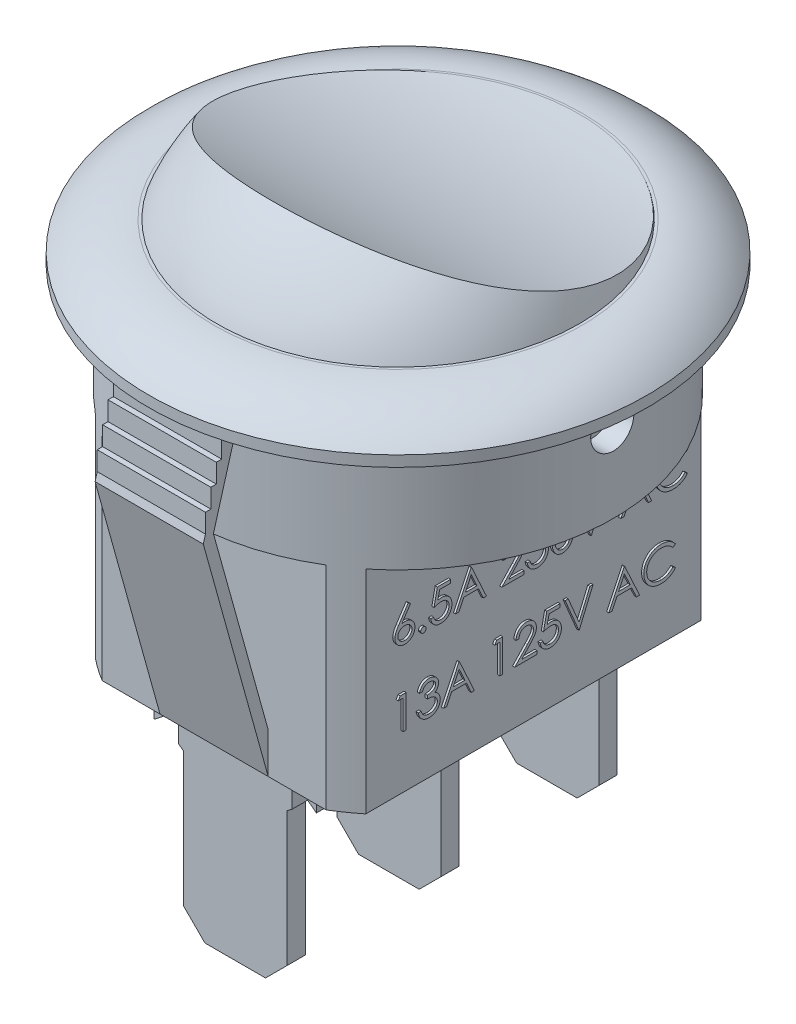
from build123d import *

# Parameters (mm, degrees)
SKETCH2_OUTSIDE_W       = 32.322
SKETCH2_OUTSIDE_H       = 32.322
SKETCH2_OUTSIDE_W_2     = 12.5
SKETCH2_OUTSIDE_H_2     = 17
CUT_EXTRUDE1_DEPTH      = 9.8
BOSS_EXTRUDE1_DEPTH     = 2.5
BOSS_EXTRUDE2_DEPTH     = 0.425
LPATTERN1_COUNT         = 2
LPATTERN1_PITCH         = 7.1
LPATTERN2_COUNT         = 2
LPATTERN2_PITCH         = 7.3
SKETCH7_R               = 1
CUT_EXTRUDE3_DEPTH      = 1
CUT_EXTRUDE2_DEPTH      = 24.890374631
CUT_EXTRUDE2_DEPTH_BACK = 24.890374631
BOSS_EXTRUDE3_DEPTH     = 0.1


with BuildPart() as part:
    # Sketch1 → Revolve1 (revolve)
    with BuildSketch(Plane.XY, mode=Mode.PRIVATE) as revolve1_sk:
        with BuildLine():
            Line((0, -8.4), (9.95, -8.4))
            Line((9.95, -8.4), (9.95, 6.6))
            Line((9.95, 6.6), (11.5, 6.6))
            Line((11.5, 6.6), (11.5, 7.1))
            ThreePointArc((11.5, 7.1), (10.134778272, 8.061026783), (8.5, 8.4))
            Line((8.5, 8.4), (0, 8.4))
            Line((0, 8.4), (0, -8.4))
        make_face()
    revolve(revolve1_sk.sketch.rotate(Axis((0, -12.991468783, 0), (0, 1, 0)), 90), axis=Axis((0, -12.991468783, 0), (0, 1, 0)))

    # Sketch2 outside → Cut-Extrude1 (cut)
    with BuildSketch(Plane.XZ.offset(8.4)):
        Rectangle(SKETCH2_OUTSIDE_W, SKETCH2_OUTSIDE_H)
        Rectangle(SKETCH2_OUTSIDE_W_2, SKETCH2_OUTSIDE_H_2, mode=Mode.SUBTRACT)
    extrude(amount=-CUT_EXTRUDE1_DEPTH, mode=Mode.SUBTRACT)

    # Sketch3 → Boss-Extrude1 (add, symmetric)
    with BuildSketch(Plane(origin=(0, 0, 0), x_dir=(0, 0, -1), z_dir=(1, 0, 0))):
        Polygon((-8.5, -8.4), (-11.5, 2.4), (-11.4, 2.75), (-11.4, 3.625), (-11.15, 3.625), (-11.15, 4.5), (-10.9, 4.5), (-10.9, 5.375), (-10.65, 5.375), (-10.65, 6.25), (-10.4, 6.25), (-10.3, 6.6), (-9.883993721, 6.6), (-11.031806176, 2.582656405), (-8.5, -6.531845831), align=None)
    boss_extrude1 = extrude(amount=BOSS_EXTRUDE1_DEPTH, both=True)

    # Mirror1: Boss-Extrude1 across plane
    add(boss_extrude1.mirror(Plane.XY))

    # Sketch4 → Boss-Extrude2 (add, symmetric)
    with BuildSketch(Plane.XY):
        Polygon((-3.75, -8.4), (-3.75, -9.723134167), (-2.625, -8.848968239), (-2.625, -10.134250504), (-2.4, -10.3), (-2.4, -16.5), (-1.4, -17.5), (1.4, -17.5), (2.4, -16.5), (2.4, -10.3), (2.625, -10.134250504), (2.625, -8.848968239), (3.75, -9.723134167), (3.75, -8.4), align=None)
    boss_extrude2 = extrude(amount=BOSS_EXTRUDE2_DEPTH, both=True)

    # LPattern1: Boss-Extrude2 ×2
    with Locations(*[(0, 0, i * LPATTERN1_PITCH) for i in range(1, LPATTERN1_COUNT)]):
        add(boss_extrude2)

    # LPattern2: Boss-Extrude2 ×2
    with Locations(*[(0, 0, -i * LPATTERN2_PITCH) for i in range(1, LPATTERN2_COUNT)]):
        add(boss_extrude2)

    # Sketch7 → Cut-Extrude3 (cut)
    with BuildSketch(Plane.ZY.offset(9.95)):
        with Locations((0, 5.1)):
            Circle(SKETCH7_R)
    cut_extrude3 = extrude(amount=-CUT_EXTRUDE3_DEPTH, mode=Mode.SUBTRACT)

    # Sketch5 → Revolve2 (revolve)
    with BuildSketch(Plane.XY, mode=Mode.PRIVATE) as revolve2_sk:
        with BuildLine():
            Line((8.94427191, 4.1), (0, 4.1))
            Line((0, 4.1), (0, 14.1))
            ThreePointArc((0, 14.1), (6.708203932, 11.1), (8.94427191, 4.1))
        make_face()
    revolve(revolve2_sk.sketch.rotate(Axis((0, 0, 0), (0, 1, 0)), 83.396729411), axis=Axis((0, 0, 0), (0, 1, 0)))

    # Sketch6 → Cut-Extrude2 (cut, two sides: drawn at the far end of the back side and taken through both)
    with BuildSketch(Plane(origin=(0, 0, 0), x_dir=(0, 0, -1), z_dir=(1, 0, 0)).offset(-CUT_EXTRUDE2_DEPTH_BACK)):
        with BuildLine():
            ThreePointArc((8.358429318, 8.437163366), (2.199449615, 13.827108421), (-5.778408085, 12))
            ThreePointArc((-5.778408085, 12), (1.037203947, 9.21548018), (8.358429318, 8.437163366))
        make_face()
    extrude(amount=CUT_EXTRUDE2_DEPTH + CUT_EXTRUDE2_DEPTH_BACK, mode=Mode.SUBTRACT)

    # Mirror2: Cut-Extrude3 across plane
    add(cut_extrude3.mirror(Plane(origin=(0, 0, 0), x_dir=(0, 0, 1), z_dir=(1, 0, 0))), mode=Mode.SUBTRACT)

    # Sketch8 → Boss-Extrude3 (add)
    # profile 1 of 19: a face of its own
    with BuildSketch(Plane(origin=(6.25, 0, 0), x_dir=(0, 0, -1), z_dir=(1, 0, 0))):
        with BuildLine():
            Line((-5.880750015, -0.835001864), (-5.77708415, -0.916432152))
            Line((-5.77708415, -0.916432152), (-6.173418285, -1.522501864))
            add(Edge.make_bspline(
                [(-6.173418285, -1.522501864), (-6.147031023, -1.518295923), (-6.095559686, -1.510091761), (-6.043460015, -1.508738356), (-6.018069727, -1.508078787)],
                knots=[0, 0, 0, 0, 1.025318673, 2, 2, 2, 2], degree=3))
            add(Edge.make_bspline(
                [(-6.018069727, -1.508078787), (-6.002824371, -1.508488549), (-5.972814343, -1.509295154), (-5.928754285, -1.515502518), (-5.886416169, -1.525284709), (-5.845975478, -1.539544247), (-5.807287057, -1.557759542), (-5.770128888, -1.579590486), (-5.735199455, -1.606164349), (-5.702048949, -1.63584933), (-5.671951622, -1.668728038), (-5.645304741, -1.703614325), (-5.62292183, -1.740471846), (-5.604761578, -1.779281931), (-5.590659487, -1.819984757), (-5.580379068, -1.862528245), (-5.5743021, -1.906941733), (-5.573476889, -1.937146665), (-5.573057708, -1.952489844)],
                knots=[0, 0, 0, 0, 1.04369286, 2.054478336, 3.041073146, 4.015093852, 4.984733326, 5.965804835, 6.960378782, 7.985147595, 9.009457201, 10.008161701, 10.986880575, 11.956520048, 12.937015923, 13.931873656, 14.949455224, 16, 16, 16, 16], degree=3))
            add(Edge.make_bspline(
                [(-5.573057708, -1.952489844), (-5.57366761, -1.973481146), (-5.574867753, -2.01478706), (-5.586826522, -2.074948506), (-5.605409227, -2.132262441), (-5.631971025, -2.1858138), (-5.664963475, -2.235529187), (-5.705196729, -2.279580101), (-5.751243938, -2.31886726), (-5.803309709, -2.351720096), (-5.859342408, -2.378549975), (-5.91820755, -2.397820793), (-5.97933347, -2.409685138), (-6.020821159, -2.411172539), (-6.041807708, -2.411924941)],
                knots=[0, 0, 0, 0, 1.031375318, 2.029502543, 3.004789286, 3.987476834, 4.960371455, 5.9300674, 6.912260825, 7.929083631, 8.949397511, 9.960523116, 10.96833055, 12, 12, 12, 12], degree=3))
            add(Edge.make_bspline(
                [(-6.041807708, -2.411924941), (-6.061992008, -2.411269995), (-6.101973573, -2.409972663), (-6.160787628, -2.398415833), (-6.217300349, -2.379684217), (-6.271115798, -2.353878098), (-6.320967489, -2.321281862), (-6.365567048, -2.282040886), (-6.404692094, -2.236993972), (-6.437252646, -2.186148109), (-6.463077817, -2.131509556), (-6.482444928, -2.074536489), (-6.493757603, -2.015436496), (-6.495338413, -1.975373151), (-6.496134631, -1.955194171)],
                knots=[0, 0, 0, 0, 1.012016664, 2.004627821, 2.994792927, 3.992885782, 4.990978636, 5.973936114, 6.964471063, 7.975201453, 8.993600317, 9.990122807, 10.98767138, 12, 12, 12, 12], degree=3))
            add(Edge.make_bspline(
                [(-6.496134631, -1.955194171), (-6.495628297, -1.939746493), (-6.494594461, -1.908205285), (-6.487375865, -1.860434987), (-6.475776667, -1.811555952), (-6.462786562, -1.770089869), (-6.4490613, -1.736120645), (-6.437638783, -1.708733435), (-6.423421356, -1.680550118), (-6.408261336, -1.650604274), (-6.390794106, -1.61966766), (-6.371801685, -1.58722323), (-6.350758978, -1.553786976), (-6.336007479, -1.531096606), (-6.328466362, -1.519497056)],
                knots=[0, 0, 0, 0, 1.173818275, 2.396712641, 3.66331629, 4.989737886, 5.693666774, 6.447286557, 7.243889047, 8.091586357, 8.998013824, 9.943181721, 10.948533338, 12, 12, 12, 12], degree=3))
            Line((-6.328466362, -1.519497056), (-5.880750015, -0.835001864))
        make_face()
        with BuildLine():
            add(Edge.make_bspline(
                [(-6.046314919, -1.661924941), (-6.057741596, -1.662258388), (-6.080061214, -1.662909707), (-6.112807249, -1.666691958), (-6.143798642, -1.673814415), (-6.173445985, -1.6828857), (-6.201195001, -1.69535844), (-6.227247361, -1.710509211), (-6.251703812, -1.728346859), (-6.274308191, -1.748618678), (-6.294802332, -1.770813549), (-6.312451388, -1.794586201), (-6.327675274, -1.819363717), (-6.340053196, -1.845353121), (-6.3496918, -1.872544478), (-6.356663908, -1.900812727), (-6.360544087, -1.93034743), (-6.361189615, -1.950375645), (-6.361519246, -1.960602825)],
                knots=[0, 0, 0, 0, 1.129588631, 2.206414736, 3.251139165, 4.268635594, 5.265702196, 6.250456724, 7.242448911, 8.251968645, 9.246821453, 10.222880186, 11.173611482, 12.116736599, 13.062300278, 14.020270554, 14.989073742, 16, 16, 16, 16], degree=3))
            add(Edge.make_bspline(
                [(-6.361519246, -1.960602825), (-6.361250806, -1.970738531), (-6.360724433, -1.990613141), (-6.355944868, -2.019901361), (-6.348644118, -2.048086321), (-6.337783949, -2.075022721), (-6.324829568, -2.101121143), (-6.307727286, -2.125436265), (-6.288777235, -2.149444867), (-6.266125549, -2.17130264), (-6.241815537, -2.191641193), (-6.215843593, -2.209418445), (-6.188775038, -2.224626805), (-6.160244429, -2.236545847), (-6.13065655, -2.246327684), (-6.099764884, -2.253211175), (-6.067547946, -2.257102829), (-6.045724258, -2.257749198), (-6.034596169, -2.258078787)],
                knots=[0, 0, 0, 0, 0.989467248, 1.94019797, 2.891935182, 3.827694429, 4.772920941, 5.730924762, 6.725747692, 7.756678648, 8.79901574, 9.819492441, 10.826891316, 11.826466727, 12.835195252, 13.867842842, 14.912794438, 16, 16, 16, 16], degree=3))
            add(Edge.make_bspline(
                [(-6.034596169, -2.258078787), (-6.023468098, -2.257749172), (-6.001644446, -2.257102752), (-5.969427249, -2.253211466), (-5.938536541, -2.246326617), (-5.90894518, -2.236549715), (-5.880427424, -2.224612454), (-5.853382544, -2.20951306), (-5.827656218, -2.191531866), (-5.803330247, -2.171337397), (-5.780772844, -2.149320461), (-5.761368296, -2.12565058), (-5.744789768, -2.100924624), (-5.731317973, -2.075125529), (-5.72057742, -2.048070034), (-5.713239648, -2.019905724), (-5.708469953, -1.990611998), (-5.707942225, -1.970738145), (-5.707673092, -1.960602825)],
                knots=[0, 0, 0, 0, 1.087397944, 2.132534446, 3.165364764, 4.174271784, 5.174024072, 6.181601208, 7.194203697, 8.236725232, 9.267838612, 10.269026844, 11.221737037, 12.171628256, 13.107553087, 14.05945871, 15.010357665, 16, 16, 16, 16], degree=3))
            add(Edge.make_bspline(
                [(-5.707673092, -1.960602825), (-5.707908932, -1.950362303), (-5.708371809, -1.930263489), (-5.713607216, -1.900825939), (-5.720868233, -1.87240085), (-5.731832389, -1.845166872), (-5.746076622, -1.819231475), (-5.763426654, -1.794463646), (-5.783497756, -1.770673497), (-5.806682415, -1.748575151), (-5.831921087, -1.72836926), (-5.858756338, -1.710532307), (-5.886831184, -1.695478746), (-5.916117159, -1.682918559), (-5.946949823, -1.673854499), (-5.978831397, -1.666717395), (-6.012169644, -1.662919387), (-6.03478819, -1.662260645), (-6.046314919, -1.661924941)],
                knots=[0, 0, 0, 0, 0.978206639, 1.919901502, 2.851605144, 3.780102724, 4.718870031, 5.675451981, 6.667674623, 7.690630536, 8.733308323, 9.756129687, 10.767539656, 11.776269907, 12.797430371, 13.836405707, 14.897401972, 16, 16, 16, 16], degree=3))
        make_face(mode=Mode.SUBTRACT)
    # profile 2 of 19: a face of its own
    with BuildSketch(Plane(origin=(6.25, 0, 0), x_dir=(0, 0, -1), z_dir=(1, 0, 0))):
        with BuildLine():
            add(Edge.make_bspline(
                [(-5.178826938, -2.142694171), (-5.17047399, -2.143190529), (-5.154099012, -2.144163579), (-5.1304251, -2.150839296), (-5.108998817, -2.162693008), (-5.08991357, -2.178491341), (-5.074182223, -2.197646625), (-5.061906072, -2.218902015), (-5.055288506, -2.242774126), (-5.054322544, -2.259243987), (-5.053826938, -2.267694171)],
                knots=[0, 0, 0, 0, 1.020151414, 1.999887582, 2.974338812, 3.990962822, 5.007586832, 5.987933904, 6.967670073, 8, 8, 8, 8], degree=3))
            add(Edge.make_bspline(
                [(-5.053826938, -2.267694171), (-5.054339339, -2.275941313), (-5.055349785, -2.292204554), (-5.061890902, -2.31589661), (-5.074275781, -2.337165283), (-5.089805064, -2.356580485), (-5.109003535, -2.372412287), (-5.130475755, -2.384165149), (-5.154043437, -2.391318854), (-5.170464719, -2.392230125), (-5.178826938, -2.392694171)],
                knots=[0, 0, 0, 0, 1.009421747, 1.99056486, 2.972319754, 3.999869655, 5.017953583, 5.993804169, 6.978383603, 8, 8, 8, 8], degree=3))
            add(Edge.make_bspline(
                [(-5.178826938, -2.392694171), (-5.187195184, -2.392246915), (-5.203532191, -2.391373755), (-5.227011902, -2.384018266), (-5.248614889, -2.372522498), (-5.267809623, -2.356550965), (-5.283468967, -2.337265189), (-5.295308417, -2.315750134), (-5.302418481, -2.292272375), (-5.303353569, -2.275954671), (-5.303826938, -2.267694171)],
                knots=[0, 0, 0, 0, 1.022052826, 1.995314843, 2.982371812, 4.00089066, 5.028879526, 6.005146991, 6.990147033, 8, 8, 8, 8], degree=3))
            add(Edge.make_bspline(
                [(-5.303826938, -2.267694171), (-5.303371753, -2.259230152), (-5.302483059, -2.242705192), (-5.295293491, -2.219048431), (-5.283560829, -2.197547671), (-5.267701374, -2.178520566), (-5.248619532, -2.16258315), (-5.227064016, -2.150983953), (-5.203475642, -2.144109491), (-5.187185668, -2.143174127), (-5.178826938, -2.142694171)],
                knots=[0, 0, 0, 0, 1.032775665, 2.016367738, 2.991239715, 4.008302682, 5.025365648, 6.011011707, 6.979408107, 8, 8, 8, 8], degree=3))
        make_face()
    # profile 3 of 19: a face of its own
    with BuildSketch(Plane(origin=(6.25, 0, 0), x_dir=(0, 0, -1), z_dir=(1, 0, 0))):
        with BuildLine():
            Line((-3.919211554, -0.873463402), (-3.919211554, -1.027309556))
            Line((-3.919211554, -1.027309556), (-4.4294279, -1.027309556))
            Line((-4.4294279, -1.027309556), (-4.510257227, -1.421840806))
            add(Edge.make_bspline(
                [(-4.510257227, -1.421840806), (-4.494376138, -1.417456404), (-4.46360904, -1.408962318), (-4.418197671, -1.399531273), (-4.375086726, -1.393846083), (-4.347111568, -1.393069807), (-4.333574535, -1.392694171)],
                knots=[0, 0, 0, 0, 1.100273476, 2.13160584, 3.095893838, 4, 4, 4, 4], degree=3))
            add(Edge.make_bspline(
                [(-4.333574535, -1.392694171), (-4.31682436, -1.393056715), (-4.283889333, -1.393769567), (-4.235701213, -1.400614645), (-4.189701402, -1.411388895), (-4.1459861, -1.426440547), (-4.104474435, -1.445687575), (-4.065548338, -1.469730407), (-4.028623518, -1.49781612), (-3.994362406, -1.53010684), (-3.96328056, -1.565644675), (-3.935952278, -1.603855191), (-3.91273974, -1.644367047), (-3.894070845, -1.687567308), (-3.879163273, -1.732978373), (-3.869240989, -1.781078052), (-3.862633829, -1.83141296), (-3.861895663, -1.865829204), (-3.861519246, -1.883379268)],
                knots=[0, 0, 0, 0, 1.052922333, 2.070308379, 3.05430497, 4.020497103, 4.973039431, 5.925935799, 6.892292201, 7.88610001, 8.88166317, 9.857072816, 10.836096531, 11.812156883, 12.81219415, 13.836441305, 14.89672472, 16, 16, 16, 16], degree=3))
            add(Edge.make_bspline(
                [(-3.861519246, -1.883379268), (-3.861804278, -1.895603076), (-3.862370491, -1.919885499), (-3.865249886, -1.9559473), (-3.870793764, -1.991245657), (-3.878237074, -2.025785253), (-3.887898111, -2.059500699), (-3.899593419, -2.092488496), (-3.913906003, -2.124543328), (-3.929605163, -2.155968497), (-3.947282225, -2.186053571), (-3.966901586, -2.214188851), (-3.987629653, -2.240796401), (-4.009933104, -2.265590858), (-4.034019245, -2.288409294), (-4.059596374, -2.309387129), (-4.086460396, -2.328879128), (-4.115026929, -2.346094068), (-4.144659421, -2.361935335), (-4.1757858, -2.374931137), (-4.207697529, -2.386549935), (-4.240853904, -2.395811161), (-4.275179824, -2.40306797), (-4.31073187, -2.407996799), (-4.347323586, -2.4115867), (-4.372127163, -2.411811425), (-4.384656265, -2.411924941)],
                knots=[0, 0, 0, 0, 1.056347294, 2.098418968, 3.122841568, 4.141288669, 5.149314143, 6.15115421, 7.162517403, 8.180376062, 9.185164535, 10.17417709, 11.141909838, 12.097768115, 13.052685741, 14.0056014, 14.954263652, 15.917497458, 16.885230207, 17.854509472, 18.828990115, 19.81800267, 20.826176721, 21.857883937, 22.917946725, 24, 24, 24, 24], degree=3))
            add(Edge.make_bspline(
                [(-4.384656265, -2.411924941), (-4.399602343, -2.411628867), (-4.429006985, -2.411046378), (-4.472087228, -2.404952741), (-4.513536344, -2.396225348), (-4.553020673, -2.383095518), (-4.590894072, -2.366643821), (-4.626646665, -2.345851176), (-4.661191998, -2.322288703), (-4.693125728, -2.294482837), (-4.722764062, -2.264090402), (-4.749295423, -2.231108556), (-4.772924099, -2.196081652), (-4.793271705, -2.158839586), (-4.810628, -2.119480216), (-4.824262995, -2.077856072), (-4.835268004, -2.034184642), (-4.839923756, -2.004118852), (-4.842288477, -1.988848018)],
                knots=[0, 0, 0, 0, 1.0467383, 2.05933395, 3.04377827, 4.011590433, 4.970194871, 5.932262533, 6.905835911, 7.896367577, 8.894135286, 9.877477877, 10.858688626, 11.851381753, 12.8477658, 13.868841284, 14.917554742, 16, 16, 16, 16], degree=3))
            Line((-4.842288477, -1.988848018), (-4.707673092, -1.988848018))
            add(Edge.make_bspline(
                [(-4.707673092, -1.988848018), (-4.704360853, -2.003152211), (-4.697994546, -2.030645666), (-4.684020654, -2.069273384), (-4.666935279, -2.103695909), (-4.64661913, -2.134368587), (-4.622383402, -2.1611153), (-4.594727933, -2.184951184), (-4.563721766, -2.206454811), (-4.529267524, -2.224378854), (-4.492919062, -2.239665462), (-4.454875972, -2.24984476), (-4.416174109, -2.257002286), (-4.389997665, -2.257718755), (-4.376843765, -2.258078787)],
                knots=[0, 0, 0, 0, 1.136247022, 2.183929868, 3.172523383, 4.106158343, 5.02341133, 5.958108904, 6.928429099, 7.938127109, 8.96079061, 9.975095812, 10.982467395, 12, 12, 12, 12], degree=3))
            add(Edge.make_bspline(
                [(-4.376843765, -2.258078787), (-4.364004432, -2.257727025), (-4.33872368, -2.257034403), (-4.3015188, -2.251703397), (-4.265598996, -2.24349301), (-4.231318701, -2.231205929), (-4.198078041, -2.216272478), (-4.166717854, -2.197108874), (-4.136330906, -2.175054581), (-4.107861706, -2.149787454), (-4.081787656, -2.121943299), (-4.058749319, -2.092167273), (-4.039559213, -2.06040291), (-4.023387452, -2.02720013), (-4.011107467, -1.992195034), (-4.002347046, -1.955551674), (-3.997202878, -1.917179539), (-3.99649523, -1.891006978), (-3.996134631, -1.877670133)],
                knots=[0, 0, 0, 0, 1.027316725, 2.022795036, 3.002884548, 3.971462791, 4.93288096, 5.914575861, 6.907176829, 7.935150275, 8.956128384, 9.956726525, 10.942570165, 11.921478529, 12.907843606, 13.90538589, 14.932640048, 16, 16, 16, 16], degree=3))
            add(Edge.make_bspline(
                [(-3.996134631, -1.877670133), (-3.996416836, -1.865637668), (-3.996969213, -1.84208583), (-4.001482315, -1.807629027), (-4.009332446, -1.775026295), (-4.020228394, -1.744120194), (-4.034062469, -1.714881576), (-4.050968032, -1.687280265), (-4.071262345, -1.66168005), (-4.094444583, -1.638068956), (-4.119840886, -1.616278295), (-4.147888205, -1.597702258), (-4.177999602, -1.582074865), (-4.209812287, -1.56858858), (-4.244082958, -1.558902546), (-4.280132943, -1.551630595), (-4.318351532, -1.547424011), (-4.344481827, -1.546840345), (-4.357913477, -1.546540325)],
                knots=[0, 0, 0, 0, 1.045622112, 2.046656509, 3.013763289, 3.955457236, 4.890082067, 5.820317437, 6.762574623, 7.722996705, 8.69280354, 9.665887285, 10.63943826, 11.638615906, 12.663482002, 13.728887084, 14.832589034, 16, 16, 16, 16], degree=3))
            add(Edge.make_bspline(
                [(-4.357913477, -1.546540325), (-4.369540161, -1.54678915), (-4.393546313, -1.54730291), (-4.430370382, -1.551085694), (-4.469066834, -1.557188249), (-4.509487332, -1.565582355), (-4.551753264, -1.576567102), (-4.595775436, -1.58973046), (-4.641646408, -1.605468459), (-4.672554004, -1.617353694), (-4.688442323, -1.623463402)],
                knots=[0, 0, 0, 0, 0.817624296, 1.688186739, 2.600797293, 3.572016777, 4.590301741, 5.671205678, 6.80286297, 8, 8, 8, 8], degree=3))
            Line((-4.688442323, -1.623463402), (-4.534596169, -0.873463402))
            Line((-4.534596169, -0.873463402), (-3.919211554, -0.873463402))
        make_face()
    # profile 4 of 19: a face of its own
    with BuildSketch(Plane(origin=(6.25, 0, 0), x_dir=(0, 0, -1), z_dir=(1, 0, 0))):
        Polygon((-2.957673092, -0.873463402), (-2.2653654, -2.373463402), (-2.411699535, -2.373463402), (-2.633454342, -1.892694171), (-3.313442323, -1.892694171), (-3.541507227, -2.373463402), (-3.688442323, -2.373463402), (-2.976903862, -0.873463402), align=None)
        Polygon((-2.968790881, -1.165831191), (-3.240425496, -1.738848018), (-2.704367804, -1.738848018), align=None, mode=Mode.SUBTRACT)
    # profile 5 of 19: a face of its own
    with BuildSketch(Plane(origin=(6.25, 0, 0), x_dir=(0, 0, -1), z_dir=(1, 0, 0))):
        with BuildLine():
            Line((-1.361519246, -1.335001864), (-1.496134631, -1.335001864))
            add(Edge.make_bspline(
                [(-1.496134631, -1.335001864), (-1.495257279, -1.317142912), (-1.493534185, -1.282068406), (-1.485464918, -1.230929588), (-1.473918828, -1.18204896), (-1.457593919, -1.135818997), (-1.4373198, -1.091830937), (-1.413006931, -1.050259502), (-1.384209567, -1.011263278), (-1.351549538, -0.975203774), (-1.316077264, -0.942123386), (-1.27780329, -0.913556854), (-1.237583992, -0.889420709), (-1.195541393, -0.869243034), (-1.151201151, -0.854097385), (-1.104965641, -0.84285954), (-1.056631725, -0.836098249), (-1.023700287, -0.835371484), (-1.006951938, -0.835001864)],
                knots=[0, 0, 0, 0, 1.10065271, 2.161652631, 3.183658789, 4.190468796, 5.17591951, 6.163126047, 7.15150782, 8.156236427, 9.156009102, 10.134482811, 11.092018607, 12.041330605, 13.001268258, 13.972401359, 14.968799086, 16, 16, 16, 16], degree=3))
            add(Edge.make_bspline(
                [(-1.006951938, -0.835001864), (-0.990504192, -0.835386916), (-0.958184959, -0.836143531), (-0.911015524, -0.842641115), (-0.866110969, -0.852817797), (-0.82355907, -0.867095833), (-0.783699328, -0.886289159), (-0.746232308, -0.909345247), (-0.710711961, -0.936010889), (-0.678737625, -0.967405381), (-0.64937702, -1.000920688), (-0.624047482, -1.036701218), (-0.602356126, -1.073656626), (-0.584275692, -1.112068713), (-0.570965918, -1.152299154), (-0.560860972, -1.19376224), (-0.555149223, -1.236887159), (-0.554272613, -1.266075683), (-0.553826938, -1.280915325)],
                knots=[0, 0, 0, 0, 1.111607364, 2.184268762, 3.212621178, 4.221274766, 5.211760367, 6.196651075, 7.1921475, 8.207485113, 9.220403448, 10.201281604, 11.166441695, 12.114753415, 13.065576456, 14.026450734, 14.996634279, 16, 16, 16, 16], degree=3))
            add(Edge.make_bspline(
                [(-0.553826938, -1.280915325), (-0.554552623, -1.301807254), (-0.555991256, -1.343224489), (-0.568297417, -1.404088001), (-0.587517351, -1.46305661), (-0.610659075, -1.510515453), (-0.634004408, -1.548758379), (-0.655041911, -1.580244967), (-0.679669688, -1.614147311), (-0.708246187, -1.650351884), (-0.740180275, -1.689142272), (-0.775761202, -1.730495041), (-0.815242694, -1.773982942), (-0.84295348, -1.803685343), (-0.857312515, -1.819076383)],
                knots=[0, 0, 0, 0, 1.184426356, 2.348067706, 3.509069118, 4.696110526, 5.333549288, 6.050745305, 6.844228056, 7.710549037, 8.667450064, 9.695053472, 10.805634456, 12, 12, 12, 12], degree=3))
            Line((-0.857312515, -1.819076383), (-1.232612996, -2.219617248))
            Line((-1.232612996, -2.219617248), (-0.534596169, -2.219617248))
            Line((-0.534596169, -2.219617248), (-0.534596169, -2.373463402))
            Line((-0.534596169, -2.373463402), (-1.553826938, -2.373463402))
            Line((-1.553826938, -2.373463402), (-0.972096169, -1.752670133))
            add(Edge.make_bspline(
                [(-0.972096169, -1.752670133), (-0.957932789, -1.737885144), (-0.930727835, -1.709486207), (-0.892249587, -1.668024939), (-0.857690021, -1.62956085), (-0.826825424, -1.594166615), (-0.80032535, -1.561324514), (-0.77680868, -1.532098213), (-0.757966283, -1.505203448), (-0.737516828, -1.474028899), (-0.717710836, -1.435966478), (-0.700691255, -1.38945204), (-0.690313463, -1.341568931), (-0.689068533, -1.309210915), (-0.688442323, -1.292934556)],
                knots=[0, 0, 0, 0, 1.329631726, 2.553950428, 3.673215718, 4.687767853, 5.603093632, 6.413772471, 7.123043292, 7.734684054, 8.834405432, 9.900288307, 10.943827018, 12, 12, 12, 12], degree=3))
            add(Edge.make_bspline(
                [(-0.688442323, -1.292934556), (-0.688714784, -1.282699671), (-0.689251752, -1.262528678), (-0.693990766, -1.232954781), (-0.701152411, -1.204427004), (-0.711414664, -1.176857596), (-0.72496041, -1.150523745), (-0.741449002, -1.125393396), (-0.760473315, -1.101098125), (-0.782481001, -1.07831814), (-0.806657367, -1.057454767), (-0.83219776, -1.038973016), (-0.859219233, -1.023527683), (-0.887607857, -1.010866184), (-0.917284486, -1.000933878), (-0.94830652, -0.994051629), (-0.980588241, -0.989730565), (-1.002631168, -0.98914592), (-1.013862996, -0.988848018)],
                knots=[0, 0, 0, 0, 0.991446411, 1.95395049, 2.89581595, 3.838931463, 4.798493298, 5.75982156, 6.748411868, 7.785213223, 8.824556874, 9.840280684, 10.836137867, 11.835679398, 12.848801643, 13.863922112, 14.911575587, 16, 16, 16, 16], degree=3))
            add(Edge.make_bspline(
                [(-1.013862996, -0.988848018), (-1.025593353, -0.98915446), (-1.048629837, -0.989756262), (-1.08245228, -0.993965975), (-1.114717613, -1.001228478), (-1.145507, -1.011161339), (-1.174872537, -1.023786431), (-1.202671413, -1.039511465), (-1.228841223, -1.058275819), (-1.253431161, -1.079550343), (-1.276087152, -1.103236458), (-1.295992956, -1.129640728), (-1.313386105, -1.158281048), (-1.328561491, -1.189080142), (-1.340885358, -1.222317476), (-1.350302422, -1.257875064), (-1.357753928, -1.295598513), (-1.360243294, -1.321649264), (-1.361519246, -1.335001864)],
                knots=[0, 0, 0, 0, 1.031018746, 2.02475058, 2.990194455, 3.934040569, 4.864654155, 5.795059489, 6.735614925, 7.690564532, 8.649604399, 9.611025574, 10.590972636, 11.591080095, 12.624614302, 13.701020113, 14.821632451, 16, 16, 16, 16], degree=3))
        make_face()
    # profile 6 of 19: a face of its own
    with BuildSketch(Plane(origin=(6.25, 0, 0), x_dir=(0, 0, -1), z_dir=(1, 0, 0))):
        with BuildLine():
            Line((0.542326908, -0.873463402), (0.542326908, -1.027309556))
            Line((0.542326908, -1.027309556), (0.032110562, -1.027309556))
            Line((0.032110562, -1.027309556), (-0.048718765, -1.421840806))
            add(Edge.make_bspline(
                [(-0.048718765, -1.421840806), (-0.032837676, -1.417456404), (-0.002070578, -1.408962318), (0.043340791, -1.399531273), (0.086451735, -1.393846083), (0.114426894, -1.393069807), (0.127963927, -1.392694171)],
                knots=[0, 0, 0, 0, 1.100273476, 2.13160584, 3.095893838, 4, 4, 4, 4], degree=3))
            add(Edge.make_bspline(
                [(0.127963927, -1.392694171), (0.144714101, -1.393056715), (0.177649129, -1.393769567), (0.225837249, -1.400614645), (0.27183706, -1.411388895), (0.315552362, -1.426440547), (0.357064026, -1.445687575), (0.395990124, -1.469730407), (0.432914944, -1.49781612), (0.467176055, -1.53010684), (0.498257902, -1.565644675), (0.525586183, -1.603855191), (0.548798722, -1.644367047), (0.567467617, -1.687567308), (0.582375189, -1.732978373), (0.592297472, -1.781078052), (0.598904633, -1.83141296), (0.599642799, -1.865829204), (0.600019215, -1.883379268)],
                knots=[0, 0, 0, 0, 1.052922333, 2.070308379, 3.05430497, 4.020497103, 4.973039431, 5.925935799, 6.892292201, 7.88610001, 8.88166317, 9.857072816, 10.836096531, 11.812156883, 12.81219415, 13.836441305, 14.89672472, 16, 16, 16, 16], degree=3))
            add(Edge.make_bspline(
                [(0.600019215, -1.883379268), (0.599734183, -1.895603076), (0.599167971, -1.919885499), (0.596288576, -1.9559473), (0.590744698, -1.991245657), (0.583301387, -2.025785253), (0.573640351, -2.059500699), (0.561945042, -2.092488496), (0.547632459, -2.124543328), (0.531933298, -2.155968497), (0.514256236, -2.186053571), (0.494636876, -2.214188851), (0.473908808, -2.240796401), (0.451605357, -2.265590858), (0.427519216, -2.288409294), (0.401942088, -2.309387129), (0.375078065, -2.328879128), (0.346511533, -2.346094068), (0.31687904, -2.361935335), (0.285752661, -2.374931137), (0.253840933, -2.386549935), (0.220684557, -2.395811161), (0.186358638, -2.40306797), (0.150806591, -2.407996799), (0.114214875, -2.4115867), (0.089411299, -2.411811425), (0.076882196, -2.411924941)],
                knots=[0, 0, 0, 0, 1.056347294, 2.098418968, 3.122841568, 4.141288669, 5.149314143, 6.15115421, 7.162517403, 8.180376062, 9.185164535, 10.17417709, 11.141909838, 12.097768115, 13.052685741, 14.0056014, 14.954263652, 15.917497458, 16.885230207, 17.854509472, 18.828990115, 19.81800267, 20.826176721, 21.857883937, 22.917946725, 24, 24, 24, 24], degree=3))
            add(Edge.make_bspline(
                [(0.076882196, -2.411924941), (0.061936119, -2.411628867), (0.032531477, -2.411046378), (-0.010548766, -2.404952741), (-0.051997883, -2.396225348), (-0.091482212, -2.383095518), (-0.129355611, -2.366643821), (-0.165108204, -2.345851176), (-0.199653537, -2.322288703), (-0.231587267, -2.294482837), (-0.261225601, -2.264090402), (-0.287756962, -2.231108556), (-0.311385638, -2.196081652), (-0.331733243, -2.158839586), (-0.349089538, -2.119480216), (-0.362724533, -2.077856072), (-0.373729543, -2.034184642), (-0.378385294, -2.004118852), (-0.380750015, -1.988848018)],
                knots=[0, 0, 0, 0, 1.0467383, 2.05933395, 3.04377827, 4.011590433, 4.970194871, 5.932262533, 6.905835911, 7.896367577, 8.894135286, 9.877477877, 10.858688626, 11.851381753, 12.8477658, 13.868841284, 14.917554742, 16, 16, 16, 16], degree=3))
            Line((-0.380750015, -1.988848018), (-0.246134631, -1.988848018))
            add(Edge.make_bspline(
                [(-0.246134631, -1.988848018), (-0.242822392, -2.003152211), (-0.236456085, -2.030645666), (-0.222482193, -2.069273384), (-0.205396817, -2.103695909), (-0.185080668, -2.134368587), (-0.160844941, -2.1611153), (-0.133189471, -2.184951184), (-0.102183304, -2.206454811), (-0.067729063, -2.224378854), (-0.0313806, -2.239665462), (0.00666249, -2.24984476), (0.045364353, -2.257002286), (0.071540797, -2.257718755), (0.084694696, -2.258078787)],
                knots=[0, 0, 0, 0, 1.136247022, 2.183929868, 3.172523383, 4.106158343, 5.02341133, 5.958108904, 6.928429099, 7.938127109, 8.96079061, 9.975095812, 10.982467395, 12, 12, 12, 12], degree=3))
            add(Edge.make_bspline(
                [(0.084694696, -2.258078787), (0.097534029, -2.257727025), (0.122814782, -2.257034403), (0.160019662, -2.251703397), (0.195939465, -2.24349301), (0.230219761, -2.231205929), (0.263460421, -2.216272478), (0.294820608, -2.197108874), (0.325207555, -2.175054581), (0.353676755, -2.149787454), (0.379750805, -2.121943299), (0.402789143, -2.092167273), (0.421979248, -2.06040291), (0.438151009, -2.02720013), (0.450430995, -1.992195034), (0.459191415, -1.955551674), (0.464335583, -1.917179539), (0.465043232, -1.891006978), (0.465403831, -1.877670133)],
                knots=[0, 0, 0, 0, 1.027316725, 2.022795036, 3.002884548, 3.971462791, 4.93288096, 5.914575861, 6.907176829, 7.935150275, 8.956128384, 9.956726525, 10.942570165, 11.921478529, 12.907843606, 13.90538589, 14.932640048, 16, 16, 16, 16], degree=3))
            add(Edge.make_bspline(
                [(0.465403831, -1.877670133), (0.465121625, -1.865637668), (0.464569248, -1.84208583), (0.460056147, -1.807629027), (0.452206016, -1.775026295), (0.441310067, -1.744120194), (0.427475992, -1.714881576), (0.41057043, -1.687280265), (0.390276117, -1.66168005), (0.367093879, -1.638068956), (0.341697575, -1.616278295), (0.313650257, -1.597702258), (0.28353886, -1.582074865), (0.251726174, -1.56858858), (0.217455504, -1.558902546), (0.181405518, -1.551630595), (0.143186929, -1.547424011), (0.117056634, -1.546840345), (0.103624985, -1.546540325)],
                knots=[0, 0, 0, 0, 1.045622112, 2.046656509, 3.013763289, 3.955457236, 4.890082067, 5.820317437, 6.762574623, 7.722996705, 8.69280354, 9.665887285, 10.63943826, 11.638615906, 12.663482002, 13.728887084, 14.832589034, 16, 16, 16, 16], degree=3))
            add(Edge.make_bspline(
                [(0.103624985, -1.546540325), (0.091998301, -1.54678915), (0.067992149, -1.54730291), (0.03116808, -1.551085694), (-0.007528373, -1.557188249), (-0.047948871, -1.565582355), (-0.090214803, -1.576567102), (-0.134236975, -1.58973046), (-0.180107946, -1.605468459), (-0.211015542, -1.617353694), (-0.226903862, -1.623463402)],
                knots=[0, 0, 0, 0, 0.817624296, 1.688186739, 2.600797293, 3.572016777, 4.590301741, 5.671205678, 6.80286297, 8, 8, 8, 8], degree=3))
            Line((-0.226903862, -1.623463402), (-0.073057708, -0.873463402))
            Line((-0.073057708, -0.873463402), (0.542326908, -0.873463402))
        make_face()
    # profile 7 of 19: a face of its own
    with BuildSketch(Plane(origin=(6.25, 0, 0), x_dir=(0, 0, -1), z_dir=(1, 0, 0))):
        with BuildLine():
            add(Edge.make_bspline(
                [(0.753865369, -1.624064364), (0.754005948, -1.600022626), (0.754279026, -1.553321204), (0.75731692, -1.485270643), (0.762363496, -1.421430519), (0.769279512, -1.361797777), (0.77769579, -1.306357021), (0.788930998, -1.25525641), (0.801707914, -1.208259436), (0.816516105, -1.165212844), (0.833225157, -1.125536686), (0.851411269, -1.088497314), (0.871796181, -1.054150771), (0.893214858, -1.021948861), (0.916534317, -0.992418706), (0.941090942, -0.965143279), (0.967843174, -0.940752958), (0.995881606, -0.918533114), (1.025460091, -0.899054769), (1.055735519, -0.881897881), (1.086916279, -0.867240795), (1.1190875, -0.855716322), (1.151960025, -0.846197388), (1.185648768, -0.839687839), (1.220209353, -0.835592021), (1.24353711, -0.835200449), (1.255367773, -0.835001864)],
                knots=[0, 0, 0, 0, 1.646270934, 3.197905019, 4.663502075, 6.030701355, 7.308322542, 8.50163776, 9.611534131, 10.641858119, 11.616356847, 12.558055219, 13.465016945, 14.349605745, 15.204443733, 16.039544428, 16.859896111, 17.680448484, 18.487036065, 19.28249412, 20.06191084, 20.843045899, 21.620316918, 22.403196591, 23.190181807, 24, 24, 24, 24], degree=3))
            add(Edge.make_bspline(
                [(1.255367773, -0.835001864), (1.267297264, -0.835210927), (1.291021268, -0.835626689), (1.326095714, -0.839622664), (1.360359864, -0.846253146), (1.393667637, -0.855647849), (1.426292631, -0.867303139), (1.457979663, -0.881911904), (1.488925555, -0.898917133), (1.518638536, -0.918898794), (1.5474448, -0.941176913), (1.574636784, -0.966360914), (1.600216963, -0.994196508), (1.62450638, -1.024385878), (1.646815922, -1.057508057), (1.668061678, -1.092986961), (1.687078265, -1.131443046), (1.705393126, -1.172234675), (1.721201834, -1.216490529), (1.735458797, -1.263961141), (1.746978355, -1.315207221), (1.756573757, -1.369959897), (1.764007284, -1.428420247), (1.769421273, -1.490462954), (1.772281167, -1.556128836), (1.772819753, -1.601025057), (1.773096138, -1.624064364)],
                knots=[0, 0, 0, 0, 0.810914788, 1.612654377, 2.396697861, 3.181598691, 3.963628158, 4.749916497, 5.551656086, 6.361998678, 7.18212741, 8.025565596, 8.878627764, 9.750805457, 10.657531673, 11.591944965, 12.560506719, 13.57287815, 14.630710178, 15.753379473, 16.941251878, 18.199788006, 19.531962791, 20.947069417, 22.433333509, 24, 24, 24, 24], degree=3))
            add(Edge.make_bspline(
                [(1.773096138, -1.624064364), (1.772816888, -1.647003181), (1.77227278, -1.691698532), (1.769453334, -1.75706895), (1.763899635, -1.818782397), (1.756952497, -1.876986881), (1.747330656, -1.931440146), (1.73549987, -1.982330624), (1.722364018, -2.029878084), (1.706149106, -2.073693003), (1.688401659, -2.114386598), (1.669092289, -2.152386805), (1.64840522, -2.188029502), (1.625867187, -2.221029393), (1.601844295, -2.251620246), (1.575822386, -2.279262085), (1.548534992, -2.304620944), (1.519643957, -2.327185927), (1.489467578, -2.346936558), (1.458627974, -2.364599636), (1.426577952, -2.37884222), (1.394043829, -2.391071523), (1.360560244, -2.400414574), (1.326168934, -2.406874798), (1.291044833, -2.41140559), (1.267301305, -2.411751224), (1.255367773, -2.411924941)],
                knots=[0, 0, 0, 0, 1.561518951, 3.042555995, 4.452378317, 5.7783523, 7.031515105, 8.214008947, 9.334062868, 10.386615937, 11.391082383, 12.354592575, 13.286541444, 14.194233754, 15.072674879, 15.931287219, 16.775624067, 17.606195743, 18.42308326, 19.229000347, 20.022332153, 20.807536673, 21.593273796, 22.3848459, 23.188221202, 24, 24, 24, 24], degree=3))
            add(Edge.make_bspline(
                [(1.255367773, -2.411924941), (1.243537439, -2.411725074), (1.220210328, -2.411330976), (1.185645003, -2.407253662), (1.152095384, -2.400698447), (1.119395918, -2.391519902), (1.08737884, -2.380284972), (1.056480432, -2.365647679), (1.026357139, -2.348790221), (0.997089329, -2.329592184), (0.969226974, -2.307597176), (0.942613286, -2.283269624), (0.917916849, -2.256002448), (0.894930808, -2.226226195), (0.873084771, -2.194214806), (0.852989325, -2.159531217), (0.834401816, -2.122312955), (0.817411749, -2.082319565), (0.802348036, -2.038967453), (0.789041875, -1.991760662), (0.778535808, -1.940282533), (0.769543112, -1.884946518), (0.762289805, -1.825514834), (0.757337952, -1.761955215), (0.754277388, -1.694307268), (0.754005215, -1.647905936), (0.753865369, -1.624064364)],
                knots=[0, 0, 0, 0, 0.810891512, 1.598919785, 2.382837074, 3.152667961, 3.926044502, 4.706494248, 5.493654104, 6.291793342, 7.103789334, 7.925228297, 8.761435821, 9.622817696, 10.50288917, 11.416980706, 12.369136599, 13.353924996, 14.394355917, 15.514179734, 16.714354668, 17.994756427, 19.357759367, 20.818452758, 22.365282078, 24, 24, 24, 24], degree=3))
        make_face()
        with BuildLine():
            add(Edge.make_bspline(
                [(0.888480754, -1.623463402), (0.888531945, -1.643498559), (0.888631298, -1.682382864), (0.891226813, -1.738887118), (0.894762627, -1.791588688), (0.899323182, -1.840554489), (0.906095875, -1.88561878), (0.913684498, -1.927091502), (0.922919394, -1.964753175), (0.93384583, -1.998862236), (0.946291157, -2.029997551), (0.959879384, -2.058969501), (0.974476837, -2.086120331), (0.990813616, -2.111206163), (1.008605786, -2.134308805), (1.027451468, -2.155837161), (1.048054004, -2.175035868), (1.076555608, -2.198061663), (1.114182669, -2.221855577), (1.161591435, -2.24257533), (1.210306486, -2.255596383), (1.243371307, -2.257252278), (1.259874985, -2.258078787)],
                knots=[0, 0, 0, 0, 1.459021318, 2.831673884, 4.118529203, 5.306027144, 6.411944654, 7.436330062, 8.375795394, 9.233974572, 10.042671642, 10.816086306, 11.563610507, 12.285937304, 12.993564865, 13.685989202, 14.367179055, 15.041617293, 16.353048772, 17.594441528, 18.799311195, 20, 20, 20, 20], degree=3))
            add(Edge.make_bspline(
                [(1.259874985, -2.258078787), (1.276485415, -2.257394024), (1.309671982, -2.256025911), (1.358157895, -2.242826452), (1.40522801, -2.222910935), (1.442115985, -2.199362004), (1.470179932, -2.176935577), (1.490287213, -2.157815014), (1.508742377, -2.136405356), (1.526246123, -2.113305658), (1.542300013, -2.088074593), (1.556898501, -2.06083349), (1.570219935, -2.031506699), (1.577809526, -2.011033954), (1.581689888, -2.000566768)],
                knots=[0, 0, 0, 0, 1.353760809, 2.704726607, 4.075137775, 5.516104923, 6.260822281, 7.007110065, 7.778089737, 8.566572457, 9.372053459, 10.217411131, 11.088608312, 12, 12, 12, 12], degree=3))
            add(Edge.make_bspline(
                [(1.581689888, -2.000566768), (1.586212075, -1.987182593), (1.595394052, -1.96000698), (1.60722767, -1.917851129), (1.616547126, -1.873621373), (1.624931426, -1.827582038), (1.630654164, -1.779393594), (1.63526037, -1.729205144), (1.637973521, -1.676978846), (1.638309843, -1.641495278), (1.638480754, -1.623463402)],
                knots=[0, 0, 0, 0, 0.884706709, 1.796334032, 2.740027952, 3.714592787, 4.726048262, 5.777819803, 6.87074269, 8, 8, 8, 8], degree=3))
            add(Edge.make_bspline(
                [(1.638480754, -1.623463402), (1.638244958, -1.605434442), (1.637783692, -1.570165943), (1.636020555, -1.518515294), (1.631467594, -1.469457683), (1.626410829, -1.422781766), (1.618954877, -1.378745922), (1.610915817, -1.336981505), (1.600115297, -1.298005923), (1.588578251, -1.26120896), (1.575373796, -1.227008679), (1.560838481, -1.195245628), (1.54531487, -1.16576646), (1.52845391, -1.138652056), (1.51045576, -1.113780967), (1.490845382, -1.091651855), (1.470400651, -1.071578868), (1.441764714, -1.048666339), (1.404275733, -1.025304184), (1.357627598, -1.003804572), (1.309083036, -0.991458161), (1.276265842, -0.989717438), (1.259874985, -0.988848018)],
                knots=[0, 0, 0, 0, 1.31362396, 2.569729283, 3.763502607, 4.902122613, 5.988968491, 7.01645872, 7.998833611, 8.933434873, 9.825090667, 10.667526885, 11.477055099, 12.250526234, 12.991942729, 13.710640831, 14.402115721, 15.076753259, 16.378508321, 17.609869233, 18.806226677, 20, 20, 20, 20], degree=3))
            add(Edge.make_bspline(
                [(1.259874985, -0.988848018), (1.243284731, -0.989718637), (1.210074, -0.991461464), (1.161024876, -1.003758572), (1.114008726, -1.0251927), (1.076618879, -1.048743717), (1.047962971, -1.071174422), (1.027784674, -1.09062576), (1.008864886, -1.111902726), (0.991435871, -1.135217832), (0.975111893, -1.160274418), (0.96012003, -1.187269603), (0.946612603, -1.216340188), (0.934147802, -1.247461517), (0.923188036, -1.281567636), (0.914147766, -1.319182919), (0.905796172, -1.36052373), (0.899883914, -1.40583209), (0.894628018, -1.454810156), (0.891250298, -1.507643293), (0.888622616, -1.564242313), (0.888528988, -1.603327666), (0.888480754, -1.623463402)],
                knots=[0, 0, 0, 0, 1.207732386, 2.417664972, 3.655092373, 4.956220595, 5.625982001, 6.301752483, 6.994047911, 7.697131622, 8.419323945, 9.170223765, 9.943494443, 10.752040957, 11.610060368, 12.549350801, 13.567764191, 14.679664412, 15.874934091, 17.154273443, 18.533957287, 20, 20, 20, 20], degree=3))
        make_face(mode=Mode.SUBTRACT)
    # profile 8 of 19: a face of its own
    with BuildSketch(Plane(origin=(6.25, 0, 0), x_dir=(0, 0, -1), z_dir=(1, 0, 0))):
        Polygon((1.926942292, -0.873463402), (2.071173062, -0.873463402), (2.571173062, -2.055554748), (3.071173062, -0.873463402), (3.215403831, -0.873463402), (2.580788446, -2.373463402), (2.561557677, -2.373463402), align=None)
    # profile 9 of 19: a face of its own
    with BuildSketch(Plane(origin=(6.25, 0, 0), x_dir=(0, 0, -1), z_dir=(1, 0, 0))):
        Polygon((4.676942292, -0.873463402), (5.369249985, -2.373463402), (5.22291585, -2.373463402), (5.001161042, -1.892694171), (4.321173062, -1.892694171), (4.093108158, -2.373463402), (3.946173062, -2.373463402), (4.657711523, -0.873463402), align=None)
        Polygon((4.665824504, -1.165831191), (4.394189888, -1.738848018), (4.930247581, -1.738848018), align=None, mode=Mode.SUBTRACT)
    # profile 10 of 19: a face of its own
    with BuildSketch(Plane(origin=(6.25, 0, 0), x_dir=(0, 0, -1), z_dir=(1, 0, 0))):
        with BuildLine():
            Line((7.023096138, -1.148703787), (6.905307677, -1.238848018))
            add(Edge.make_bspline(
                [(6.905307677, -1.238848018), (6.896905153, -1.22883403), (6.88021339, -1.208941067), (6.853359446, -1.181006976), (6.825373028, -1.15483615), (6.796264833, -1.130303916), (6.765510925, -1.108268159), (6.733856297, -1.087580543), (6.70077142, -1.069037227), (6.655020677, -1.04655309), (6.595171599, -1.023090452), (6.519830954, -1.003417639), (6.44118334, -0.990894278), (6.387527226, -0.989537917), (6.360235562, -0.988848018)],
                knots=[0, 0, 0, 0, 0.757959112, 1.505699292, 2.245454638, 2.979532153, 3.711538275, 4.438200793, 5.171680507, 5.909471876, 7.393775596, 8.890124382, 10.418191784, 12, 12, 12, 12], degree=3))
            add(Edge.make_bspline(
                [(6.360235562, -0.988848018), (6.345199862, -0.989021144), (6.315268008, -0.989365791), (6.270847234, -0.993912559), (6.227255926, -1.000303078), (6.18452244, -1.009785359), (6.142701172, -1.021773624), (6.101518714, -1.036098802), (6.061571314, -1.053822305), (6.022306355, -1.073411559), (5.984686693, -1.095537607), (5.949091673, -1.1196719), (5.915651115, -1.14554437), (5.884338567, -1.173251987), (5.855122018, -1.20266997), (5.82821317, -1.234111831), (5.803705137, -1.267477048), (5.781112127, -1.302325651), (5.760878098, -1.338556133), (5.743936721, -1.376302592), (5.728934526, -1.414918636), (5.717063422, -1.454840562), (5.7076672, -1.495787462), (5.701183916, -1.537869228), (5.696688857, -1.580997948), (5.696345924, -1.610230511), (5.696173062, -1.624965806)],
                knots=[0, 0, 0, 0, 1.054917814, 2.100044995, 3.131103042, 4.146048494, 5.169673617, 6.183595914, 7.203665975, 8.234915748, 9.262203917, 10.264457458, 11.251630812, 12.227803204, 13.197192746, 14.159520551, 15.12972552, 16.100847026, 17.073214652, 18.039054194, 19.002613845, 19.979014051, 20.95965708, 21.949030935, 22.966165397, 24, 24, 24, 24], degree=3))
            add(Edge.make_bspline(
                [(5.696173062, -1.624965806), (5.696713841, -1.647136372), (5.69777559, -1.690665337), (5.707224876, -1.75442417), (5.721584201, -1.815504458), (5.743105163, -1.873524391), (5.769641898, -1.929199401), (5.803173589, -1.981587481), (5.842009248, -2.031480295), (5.886698285, -2.077698701), (5.935729349, -2.119918869), (5.988335597, -2.15709769), (6.044386006, -2.188089782), (6.103261704, -2.213879474), (6.165415753, -2.233703785), (6.230736383, -2.247659838), (6.299081524, -2.25676363), (6.345782695, -2.257635211), (6.369550465, -2.258078787)],
                knots=[0, 0, 0, 0, 1.029171465, 2.020641659, 2.987623507, 3.938342917, 4.889210282, 5.84687017, 6.821220943, 7.821438502, 8.827599549, 9.822697543, 10.807740252, 11.797342354, 12.80366471, 13.83203677, 14.896651826, 16, 16, 16, 16], degree=3))
            add(Edge.make_bspline(
                [(6.369550465, -2.258078787), (6.395737332, -2.257355024), (6.44727935, -2.255930486), (6.522865647, -2.243862236), (6.595223832, -2.224294557), (6.664357798, -2.196909733), (6.730072647, -2.161310324), (6.792471215, -2.118154091), (6.851606174, -2.06703052), (6.887165295, -2.027994893), (6.905307677, -2.008078787)],
                knots=[0, 0, 0, 0, 1.028121516, 2.023589091, 2.998037872, 3.967518031, 4.937445131, 5.927275754, 6.942489185, 8, 8, 8, 8], degree=3))
            Line((6.905307677, -2.008078787), (7.023096138, -2.097321575))
            add(Edge.make_bspline(
                [(7.023096138, -2.097321575), (7.013616949, -2.10955234), (6.994703973, -2.133955286), (6.964079109, -2.168357447), (6.93181741, -2.20071632), (6.897679249, -2.230771014), (6.862057338, -2.259122928), (6.824312061, -2.28496657), (6.784939619, -2.308662663), (6.744073414, -2.330359917), (6.701756865, -2.349610165), (6.658040679, -2.366090352), (6.613113289, -2.380286733), (6.566972643, -2.391966134), (6.519523033, -2.401082313), (6.470935687, -2.40717646), (6.42110574, -2.411351566), (6.387487988, -2.411732101), (6.370451908, -2.411924941)],
                knots=[0, 0, 0, 0, 0.986787822, 1.968848986, 2.935600012, 3.899624008, 4.868462664, 5.837806735, 6.815139263, 7.798259679, 8.787526145, 9.778297419, 10.776456485, 11.791383307, 12.812564526, 13.85620153, 14.913611965, 16, 16, 16, 16], degree=3))
            add(Edge.make_bspline(
                [(6.370451908, -2.411924941), (6.354318908, -2.411812658), (6.322417897, -2.411590633), (6.275318433, -2.40799399), (6.229465755, -2.40308696), (6.184990915, -2.395698332), (6.141651212, -2.38697933), (6.099839533, -2.375291648), (6.059144443, -2.362199148), (6.019729439, -2.346811297), (5.981560997, -2.329447218), (5.94476222, -2.309822265), (5.909350035, -2.288101465), (5.874976283, -2.264763604), (5.842148747, -2.239059046), (5.810582951, -2.211344774), (5.78010189, -2.181714198), (5.761243596, -2.160347832), (5.751762004, -2.149605229)],
                knots=[0, 0, 0, 0, 1.114604814, 2.203992996, 3.262667896, 4.300477797, 5.318619304, 6.316056647, 7.298880507, 8.271930387, 9.238335007, 10.195173496, 11.151986948, 12.108099108, 13.064862484, 14.031167946, 15.010108607, 16, 16, 16, 16], degree=3))
            add(Edge.make_bspline(
                [(5.751762004, -2.149605229), (5.736575299, -2.13094472), (5.706385238, -2.093848986), (5.667759945, -2.033726423), (5.634696707, -1.970954334), (5.60796417, -1.905202936), (5.587065855, -1.83661977), (5.5725882, -1.765170263), (5.56318037, -1.690921145), (5.562104532, -1.640419664), (5.561557677, -1.61474946)],
                knots=[0, 0, 0, 0, 0.994628077, 1.977248131, 2.950237994, 3.925870899, 4.908910175, 5.911660606, 6.938484602, 8, 8, 8, 8], degree=3))
            add(Edge.make_bspline(
                [(5.561557677, -1.61474946), (5.562224188, -1.587768551), (5.563535508, -1.534685298), (5.574676563, -1.456782175), (5.592598905, -1.382145861), (5.618054714, -1.310915685), (5.650328436, -1.242716993), (5.690196985, -1.178070763), (5.737197189, -1.116563563), (5.790960432, -1.059128669), (5.849917861, -1.006611804), (5.913054496, -0.960409145), (5.980246759, -0.921958781), (6.05075441, -0.889817569), (6.125105416, -0.865112799), (6.203141146, -0.847818576), (6.284714966, -0.837054098), (6.340370292, -0.835693294), (6.368649023, -0.835001864)],
                knots=[0, 0, 0, 0, 1.032925535, 2.032216505, 3.007276963, 3.968222605, 4.92396291, 5.891752235, 6.871517503, 7.883894988, 8.900124299, 9.891468569, 10.874487609, 11.85992873, 12.854644235, 13.869047385, 14.917252991, 16, 16, 16, 16], degree=3))
            add(Edge.make_bspline(
                [(6.368649023, -0.835001864), (6.385883797, -0.835208494), (6.419998296, -0.835617499), (6.470463718, -0.839605846), (6.519596144, -0.846254534), (6.567429422, -0.855304278), (6.614196257, -0.866535987), (6.659539218, -0.881167544), (6.703724369, -0.897897486), (6.746473044, -0.9171654), (6.787580137, -0.938794003), (6.827032845, -0.962543556), (6.864517785, -0.988384616), (6.90029872, -1.016097405), (6.933777096, -1.046268216), (6.965903444, -1.078067186), (6.995586763, -1.112410253), (7.013909561, -1.136583796), (7.023096138, -1.148703787)],
                knots=[0, 0, 0, 0, 1.096760587, 2.17092713, 3.219439832, 4.250915756, 5.268269357, 6.278326846, 7.281116186, 8.274029601, 9.260640565, 10.235837813, 11.203064059, 12.156899882, 13.114053108, 14.069676657, 15.032185724, 16, 16, 16, 16], degree=3))
        make_face()
    # profile 11 of 19: a face of its own
    with BuildSketch(Plane(origin=(6.25, 0, 0), x_dir=(0, 0, -1), z_dir=(1, 0, 0))):
        Polygon((-6.254247612, -4.373463402), (-5.976903862, -4.373463402), (-5.976903862, -5.873463402), (-6.111519246, -5.873463402), (-6.111519246, -4.527309556), (-6.342288477, -4.527309556), align=None)
    # profile 12 of 19: a face of its own
    with BuildSketch(Plane(origin=(6.25, 0, 0), x_dir=(0, 0, -1), z_dir=(1, 0, 0))):
        with BuildLine():
            Line((-5.226903862, -4.719617248), (-5.361519246, -4.719617248))
            add(Edge.make_bspline(
                [(-5.361519246, -4.719617248), (-5.357872296, -4.704517612), (-5.350742806, -4.674999059), (-5.335872418, -4.632824519), (-5.319672737, -4.592914438), (-5.300220264, -4.556016121), (-5.279002226, -4.52138802), (-5.254692488, -4.489815538), (-5.228412607, -4.460495695), (-5.199344772, -4.434475736), (-5.16886106, -4.410913852), (-5.136531937, -4.390824542), (-5.10300784, -4.373542762), (-5.068056497, -4.35930552), (-5.031573852, -4.348580296), (-4.993889728, -4.340798808), (-4.95490537, -4.335745473), (-4.928442117, -4.335252289), (-4.915004823, -4.335001864)],
                knots=[0, 0, 0, 0, 1.162005537, 2.271625781, 3.343758855, 4.383309926, 5.390229558, 6.379919256, 7.361854164, 8.333198761, 9.295911338, 10.242430842, 11.177959212, 12.116337295, 13.062827104, 14.020064771, 14.994644689, 16, 16, 16, 16], degree=3))
            add(Edge.make_bspline(
                [(-4.915004823, -4.335001864), (-4.895426505, -4.335592962), (-4.856696929, -4.336762266), (-4.79979848, -4.347439882), (-4.744929843, -4.364336367), (-4.692691594, -4.38768225), (-4.644169409, -4.416476813), (-4.600996758, -4.450747414), (-4.563758824, -4.489832829), (-4.532518377, -4.533003928), (-4.508057663, -4.579142004), (-4.490020646, -4.626627785), (-4.479039925, -4.67534863), (-4.477616829, -4.708244607), (-4.476903862, -4.724725421)],
                knots=[0, 0, 0, 0, 1.083050992, 2.142477498, 3.193116406, 4.255571735, 5.30263384, 6.308962982, 7.297363603, 8.282367274, 9.249857812, 10.179914175, 11.08814088, 12, 12, 12, 12], degree=3))
            add(Edge.make_bspline(
                [(-4.476903862, -4.724725421), (-4.477402543, -4.740585476), (-4.478378386, -4.771621142), (-4.48666426, -4.816930355), (-4.500608373, -4.859633898), (-4.519923985, -4.899911539), (-4.544927507, -4.937507899), (-4.575215806, -4.972507567), (-4.611002661, -5.005065777), (-4.638122206, -5.02371698), (-4.65208415, -5.033319171)],
                knots=[0, 0, 0, 0, 1.024540389, 2.004866551, 2.965041327, 3.920577974, 4.882998113, 5.874504559, 6.905732034, 8, 8, 8, 8], degree=3))
            add(Edge.make_bspline(
                [(-4.65208415, -5.033319171), (-4.636127684, -5.041024102), (-4.604513309, -5.056289798), (-4.561420225, -5.08622798), (-4.522301136, -5.120794986), (-4.500485256, -5.147770409), (-4.489524054, -5.161323979)],
                knots=[0, 0, 0, 0, 1.015518401, 2.012035669, 3.001164323, 4, 4, 4, 4], degree=3))
            add(Edge.make_bspline(
                [(-4.489524054, -5.161323979), (-4.482306336, -5.171205873), (-4.467989095, -5.190807837), (-4.450316723, -5.222323448), (-4.434284245, -5.254188372), (-4.421791294, -5.287256689), (-4.41211678, -5.321145123), (-4.405201337, -5.355911864), (-4.400905277, -5.391585303), (-4.400290041, -5.415719223), (-4.399980785, -5.427850421)],
                knots=[0, 0, 0, 0, 1.025084078, 2.033381695, 3.024893161, 4.013698104, 4.991890475, 5.976764909, 6.982997093, 8, 8, 8, 8], degree=3))
            add(Edge.make_bspline(
                [(-4.399980785, -5.427850421), (-4.400749862, -5.448854588), (-4.402284397, -5.490764074), (-4.416000429, -5.552681812), (-4.437263246, -5.613207027), (-4.467459076, -5.671096244), (-4.504259437, -5.725259264), (-4.548041147, -5.77372054), (-4.598306751, -5.815377084), (-4.654366315, -5.850181468), (-4.715102227, -5.878003435), (-4.780063195, -5.897313767), (-4.848313218, -5.909890624), (-4.895116346, -5.911239282), (-4.918911073, -5.911924941)],
                knots=[0, 0, 0, 0, 0.955779014, 1.907060117, 2.875433937, 3.871313158, 4.872415639, 5.851225146, 6.836215519, 7.83643374, 8.849228613, 9.86973379, 10.916971861, 12, 12, 12, 12], degree=3))
            add(Edge.make_bspline(
                [(-4.918911073, -5.911924941), (-4.934947916, -5.911552849), (-4.966503075, -5.910820697), (-5.012893146, -5.905815583), (-5.057173874, -5.896674152), (-5.099405131, -5.884372735), (-5.139624432, -5.868776274), (-5.177709048, -5.849353975), (-5.213893289, -5.826506189), (-5.247835696, -5.799963222), (-5.279532225, -5.77027122), (-5.308140536, -5.736903072), (-5.33413759, -5.700475614), (-5.356827292, -5.660565732), (-5.377243129, -5.617689194), (-5.394034967, -5.57129698), (-5.408814497, -5.521803828), (-5.415685981, -5.487313368), (-5.419211554, -5.469617248)],
                knots=[0, 0, 0, 0, 1.048658725, 2.063410685, 3.046034179, 4.001477787, 4.936774919, 5.862367409, 6.792675028, 7.730719943, 8.675894397, 9.627829632, 10.600096036, 11.597688215, 12.626045268, 13.701542398, 14.82072376, 16, 16, 16, 16], degree=3))
            Line((-5.419211554, -5.469617248), (-5.284596169, -5.469617248))
            add(Edge.make_bspline(
                [(-5.284596169, -5.469617248), (-5.281089044, -5.481166825), (-5.274267382, -5.503631756), (-5.26265554, -5.535963316), (-5.24942628, -5.565602481), (-5.235234327, -5.592766676), (-5.220329278, -5.61772342), (-5.203651453, -5.639812793), (-5.186436105, -5.660005022), (-5.17345924, -5.671381285), (-5.167108188, -5.676948979)],
                knots=[0, 0, 0, 0, 1.198163088, 2.33053128, 3.407730985, 4.417276592, 5.372219308, 6.28897303, 7.162600585, 8, 8, 8, 8], degree=3))
            add(Edge.make_bspline(
                [(-5.167108188, -5.676948979), (-5.158709656, -5.683423979), (-5.141938514, -5.696353993), (-5.114609273, -5.712854691), (-5.085867178, -5.727152273), (-5.055089461, -5.738073857), (-5.022940274, -5.747321426), (-4.988899974, -5.753373077), (-4.953268881, -5.75752515), (-4.92893984, -5.75789155), (-4.916507227, -5.758078787)],
                knots=[0, 0, 0, 0, 0.946170439, 1.889420265, 2.845303464, 3.807233317, 4.801018734, 5.828864929, 6.890507805, 8, 8, 8, 8], degree=3))
            add(Edge.make_bspline(
                [(-4.916507227, -5.758078787), (-4.902470012, -5.757814827), (-4.875021449, -5.757298678), (-4.834969366, -5.752551946), (-4.796866174, -5.745638912), (-4.76113492, -5.734961919), (-4.72730756, -5.721770126), (-4.695858282, -5.705206523), (-4.666374236, -5.685773071), (-4.639233062, -5.66368486), (-4.614827845, -5.63950422), (-4.593339482, -5.614212903), (-4.57507177, -5.587917548), (-4.560335951, -5.560472639), (-4.548700001, -5.531991826), (-4.540778629, -5.502395185), (-4.535270837, -5.471924928), (-4.534822289, -5.451212513), (-4.534596169, -5.440771094)],
                knots=[0, 0, 0, 0, 1.217147791, 2.380027433, 3.494444702, 4.572153297, 5.609568379, 6.639424714, 7.649109417, 8.668170816, 9.669597737, 10.625200337, 11.543417969, 12.441394052, 13.322311151, 14.205496177, 15.095365482, 16, 16, 16, 16], degree=3))
            add(Edge.make_bspline(
                [(-4.534596169, -5.440771094), (-4.535252013, -5.426794806), (-4.536560436, -5.398911774), (-4.546549828, -5.357889957), (-4.562980769, -5.318365637), (-4.585983274, -5.281013156), (-4.613984301, -5.246394912), (-4.646712118, -5.215507134), (-4.684438502, -5.190019952), (-4.719161303, -5.172410528), (-4.749917798, -5.160394638), (-4.776238677, -5.152391082), (-4.805705793, -5.145613801), (-4.8379628, -5.139308542), (-4.87325275, -5.13394225), (-4.911537223, -5.129467186), (-4.952823978, -5.125886454), (-4.981405906, -5.124287413), (-4.996134631, -5.123463402)],
                knots=[0, 0, 0, 0, 1.07054697, 2.135767047, 3.216561865, 4.33974944, 5.486079747, 6.621378074, 7.775625952, 8.963672916, 9.598146892, 10.304877434, 11.070270905, 11.915000392, 12.823868403, 13.805723172, 14.86925407, 16, 16, 16, 16], degree=3))
            Line((-4.996134631, -5.123463402), (-4.996134631, -4.969617248))
            add(Edge.make_bspline(
                [(-4.996134631, -4.969617248), (-4.977576988, -4.969302332), (-4.941227126, -4.96868549), (-4.888129566, -4.961224914), (-4.83735529, -4.950904644), (-4.790029543, -4.935096705), (-4.74689438, -4.916736578), (-4.709471694, -4.895371345), (-4.678285773, -4.871622167), (-4.653488171, -4.845122477), (-4.634832788, -4.816701742), (-4.621192732, -4.787080318), (-4.613135449, -4.755998577), (-4.612059877, -4.734786577), (-4.611519246, -4.72412446)],
                knots=[0, 0, 0, 0, 1.321986639, 2.589447074, 3.816329219, 5.01088745, 6.139805852, 7.153945165, 8.075214402, 8.924034688, 9.728124013, 10.488707548, 11.240355623, 12, 12, 12, 12], degree=3))
            add(Edge.make_bspline(
                [(-4.611519246, -4.72412446), (-4.611696851, -4.71629114), (-4.612050187, -4.700707123), (-4.616506163, -4.677939237), (-4.623202181, -4.655867403), (-4.632407779, -4.634585484), (-4.644729293, -4.614241081), (-4.659474716, -4.594660746), (-4.677032473, -4.575956269), (-4.69715195, -4.558521846), (-4.718757009, -4.541906459), (-4.742435484, -4.527800614), (-4.767473431, -4.515738445), (-4.793898568, -4.505791515), (-4.821796653, -4.498308963), (-4.851036606, -4.49293646), (-4.881674185, -4.489577465), (-4.902576356, -4.489093858), (-4.913201938, -4.488848018)],
                knots=[0, 0, 0, 0, 0.884392785, 1.759457502, 2.611959086, 3.489218968, 4.37281399, 5.2945488, 6.255912374, 7.266815255, 8.301784654, 9.332968512, 10.37626691, 11.440494194, 12.520033166, 13.637162961, 14.798855837, 16, 16, 16, 16], degree=3))
            add(Edge.make_bspline(
                [(-4.913201938, -4.488848018), (-4.930281225, -4.489444316), (-4.963641043, -4.490609024), (-5.01173315, -4.500810316), (-5.056441436, -4.517086637), (-5.090615151, -4.536515074), (-5.11585054, -4.555693831), (-5.133883513, -4.572443426), (-5.151592303, -4.591057493), (-5.167811879, -4.612682511), (-5.184215012, -4.635853992), (-5.199148395, -4.661749856), (-5.213659692, -4.689694596), (-5.222403642, -4.709449868), (-5.226903862, -4.719617248)],
                knots=[0, 0, 0, 0, 1.472543308, 2.876219568, 4.221790263, 5.565193594, 6.249813518, 6.953379497, 7.687249741, 8.463570142, 9.283606569, 10.136032583, 11.040678096, 12, 12, 12, 12], degree=3))
        make_face()
    # profile 13 of 19: a face of its own
    with BuildSketch(Plane(origin=(6.25, 0, 0), x_dir=(0, 0, -1), z_dir=(1, 0, 0))):
        Polygon((-3.5153654, -4.373463402), (-2.823057708, -5.873463402), (-2.969391842, -5.873463402), (-3.19114665, -5.392694171), (-3.871134631, -5.392694171), (-4.099199535, -5.873463402), (-4.246134631, -5.873463402), (-3.534596169, -4.373463402), align=None)
        Polygon((-3.526483188, -4.665831191), (-3.798117804, -5.238848018), (-3.262060112, -5.238848018), align=None, mode=Mode.SUBTRACT)
    # profile 14 of 19: a face of its own
    with BuildSketch(Plane(origin=(6.25, 0, 0), x_dir=(0, 0, -1), z_dir=(1, 0, 0))):
        Polygon((-1.79270915, -4.373463402), (-1.5153654, -4.373463402), (-1.5153654, -5.873463402), (-1.649980785, -5.873463402), (-1.649980785, -4.527309556), (-1.880750015, -4.527309556), align=None)
    # profile 15 of 19: a face of its own
    with BuildSketch(Plane(origin=(6.25, 0, 0), x_dir=(0, 0, -1), z_dir=(1, 0, 0))):
        with BuildLine():
            Line((-0.7653654, -4.835001864), (-0.899980785, -4.835001864))
            add(Edge.make_bspline(
                [(-0.899980785, -4.835001864), (-0.899103433, -4.817142912), (-0.897380339, -4.782068406), (-0.889311072, -4.730929588), (-0.877764982, -4.68204896), (-0.861440073, -4.635818997), (-0.841165954, -4.591830937), (-0.816853085, -4.550259502), (-0.78805572, -4.511263278), (-0.755395692, -4.475203774), (-0.719923418, -4.442123386), (-0.681649444, -4.413556854), (-0.641430146, -4.389420709), (-0.599387547, -4.369243034), (-0.555047305, -4.354097385), (-0.508811795, -4.34285954), (-0.460477879, -4.336098249), (-0.427546441, -4.335371484), (-0.410798092, -4.335001864)],
                knots=[0, 0, 0, 0, 1.10065271, 2.161652631, 3.183658789, 4.190468796, 5.17591951, 6.163126047, 7.15150782, 8.156236427, 9.156009102, 10.134482811, 11.092018607, 12.041330605, 13.001268258, 13.972401359, 14.968799086, 16, 16, 16, 16], degree=3))
            add(Edge.make_bspline(
                [(-0.410798092, -4.335001864), (-0.394350346, -4.335386916), (-0.362031113, -4.336143531), (-0.314861678, -4.342641115), (-0.269957123, -4.352817797), (-0.227405223, -4.367095833), (-0.187545481, -4.386289159), (-0.150078462, -4.409345247), (-0.114558115, -4.436010889), (-0.082583779, -4.467405381), (-0.053223174, -4.500920688), (-0.027893636, -4.536701218), (-0.00620228, -4.573656626), (0.011878154, -4.612068713), (0.025187928, -4.652299154), (0.035292874, -4.69376224), (0.041004623, -4.736887159), (0.041881233, -4.766075683), (0.042326908, -4.780915325)],
                knots=[0, 0, 0, 0, 1.111607364, 2.184268762, 3.212621178, 4.221274766, 5.211760367, 6.196651075, 7.1921475, 8.207485113, 9.220403448, 10.201281604, 11.166441695, 12.114753415, 13.065576456, 14.026450734, 14.996634279, 16, 16, 16, 16], degree=3))
            add(Edge.make_bspline(
                [(0.042326908, -4.780915325), (0.041601224, -4.801807254), (0.04016259, -4.843224489), (0.027856429, -4.904088001), (0.008636495, -4.96305661), (-0.014505229, -5.010515453), (-0.037850562, -5.048758379), (-0.058888065, -5.080244967), (-0.083515841, -5.114147311), (-0.112092341, -5.150351884), (-0.144026429, -5.189142272), (-0.179607356, -5.230495041), (-0.219088848, -5.273982942), (-0.246799634, -5.303685343), (-0.261158669, -5.319076383)],
                knots=[0, 0, 0, 0, 1.184426356, 2.348067706, 3.509069118, 4.696110526, 5.333549288, 6.050745305, 6.844228056, 7.710549037, 8.667450064, 9.695053472, 10.805634456, 12, 12, 12, 12], degree=3))
            Line((-0.261158669, -5.319076383), (-0.63645915, -5.719617248))
            Line((-0.63645915, -5.719617248), (0.061557677, -5.719617248))
            Line((0.061557677, -5.719617248), (0.061557677, -5.873463402))
            Line((0.061557677, -5.873463402), (-0.957673092, -5.873463402))
            Line((-0.957673092, -5.873463402), (-0.375942323, -5.252670133))
            add(Edge.make_bspline(
                [(-0.375942323, -5.252670133), (-0.361778943, -5.237885144), (-0.334573989, -5.209486207), (-0.296095741, -5.168024939), (-0.261536175, -5.12956085), (-0.230671578, -5.094166615), (-0.204171504, -5.061324514), (-0.180654833, -5.032098213), (-0.161812437, -5.005203448), (-0.141362982, -4.974028899), (-0.12155699, -4.935966478), (-0.104537409, -4.88945204), (-0.094159617, -4.841568931), (-0.092914687, -4.809210915), (-0.092288477, -4.792934556)],
                knots=[0, 0, 0, 0, 1.329631726, 2.553950428, 3.673215718, 4.687767853, 5.603093632, 6.413772471, 7.123043292, 7.734684054, 8.834405432, 9.900288307, 10.943827018, 12, 12, 12, 12], degree=3))
            add(Edge.make_bspline(
                [(-0.092288477, -4.792934556), (-0.092560938, -4.782699671), (-0.093097906, -4.762528678), (-0.097836919, -4.732954781), (-0.104998565, -4.704427004), (-0.115260818, -4.676857596), (-0.128806564, -4.650523745), (-0.145295155, -4.625393396), (-0.164319468, -4.601098125), (-0.186327155, -4.57831814), (-0.210503521, -4.557454767), (-0.236043914, -4.538973016), (-0.263065387, -4.523527683), (-0.291454011, -4.510866184), (-0.32113064, -4.500933878), (-0.352152674, -4.494051629), (-0.384434395, -4.489730565), (-0.406477322, -4.48914592), (-0.41770915, -4.488848018)],
                knots=[0, 0, 0, 0, 0.991446411, 1.95395049, 2.89581595, 3.838931463, 4.798493298, 5.75982156, 6.748411868, 7.785213223, 8.824556874, 9.840280684, 10.836137867, 11.835679398, 12.848801643, 13.863922112, 14.911575587, 16, 16, 16, 16], degree=3))
            add(Edge.make_bspline(
                [(-0.41770915, -4.488848018), (-0.429439507, -4.48915446), (-0.452475991, -4.489756262), (-0.486298434, -4.493965975), (-0.518563767, -4.501228478), (-0.549353154, -4.511161339), (-0.578718691, -4.523786431), (-0.606517567, -4.539511465), (-0.632687376, -4.558275819), (-0.657277315, -4.579550343), (-0.679933306, -4.603236458), (-0.69983911, -4.629640728), (-0.717232259, -4.658281048), (-0.732407645, -4.689080142), (-0.744731512, -4.722317476), (-0.754148576, -4.757875064), (-0.761600082, -4.795598513), (-0.764089448, -4.821649264), (-0.7653654, -4.835001864)],
                knots=[0, 0, 0, 0, 1.031018746, 2.02475058, 2.990194455, 3.934040569, 4.864654155, 5.795059489, 6.735614925, 7.690564532, 8.649604399, 9.611025574, 10.590972636, 11.591080095, 12.624614302, 13.701020113, 14.821632451, 16, 16, 16, 16], degree=3))
        make_face()
    # profile 16 of 19: a face of its own
    with BuildSketch(Plane(origin=(6.25, 0, 0), x_dir=(0, 0, -1), z_dir=(1, 0, 0))):
        with BuildLine():
            Line((1.138480754, -4.373463402), (1.138480754, -4.527309556))
            Line((1.138480754, -4.527309556), (0.628264408, -4.527309556))
            Line((0.628264408, -4.527309556), (0.547435081, -4.921840806))
            add(Edge.make_bspline(
                [(0.547435081, -4.921840806), (0.56331617, -4.917456404), (0.594083268, -4.908962318), (0.639494637, -4.899531273), (0.682605581, -4.893846083), (0.71058074, -4.893069807), (0.724117773, -4.892694171)],
                knots=[0, 0, 0, 0, 1.100273476, 2.13160584, 3.095893838, 4, 4, 4, 4], degree=3))
            add(Edge.make_bspline(
                [(0.724117773, -4.892694171), (0.740867947, -4.893056715), (0.773802975, -4.893769567), (0.821991095, -4.900614645), (0.867990906, -4.911388895), (0.911706208, -4.926440547), (0.953217872, -4.945687575), (0.99214397, -4.969730407), (1.02906879, -4.99781612), (1.063329902, -5.03010684), (1.094411748, -5.065644675), (1.121740029, -5.103855191), (1.144952568, -5.144367047), (1.163621463, -5.187567308), (1.178529035, -5.232978373), (1.188451318, -5.281078052), (1.195058479, -5.33141296), (1.195796645, -5.365829204), (1.196173062, -5.383379268)],
                knots=[0, 0, 0, 0, 1.052922333, 2.070308379, 3.05430497, 4.020497103, 4.973039431, 5.925935799, 6.892292201, 7.88610001, 8.88166317, 9.857072816, 10.836096531, 11.812156883, 12.81219415, 13.836441305, 14.89672472, 16, 16, 16, 16], degree=3))
            add(Edge.make_bspline(
                [(1.196173062, -5.383379268), (1.195888029, -5.395603076), (1.195321817, -5.419885499), (1.192442422, -5.4559473), (1.186898544, -5.491245657), (1.179455233, -5.525785253), (1.169794197, -5.559500699), (1.158098888, -5.592488496), (1.143786305, -5.624543328), (1.128087144, -5.655968497), (1.110410082, -5.686053571), (1.090790722, -5.714188851), (1.070062654, -5.740796401), (1.047759203, -5.765590858), (1.023673063, -5.788409294), (0.998095934, -5.809387129), (0.971231912, -5.828879128), (0.942665379, -5.846094068), (0.913032886, -5.861935335), (0.881906508, -5.874931137), (0.849994779, -5.886549935), (0.816838404, -5.895811161), (0.782512484, -5.90306797), (0.746960437, -5.907996799), (0.710368722, -5.9115867), (0.685565145, -5.911811425), (0.673036042, -5.911924941)],
                knots=[0, 0, 0, 0, 1.056347294, 2.098418968, 3.122841568, 4.141288669, 5.149314143, 6.15115421, 7.162517403, 8.180376062, 9.185164535, 10.17417709, 11.141909838, 12.097768115, 13.052685741, 14.0056014, 14.954263652, 15.917497458, 16.885230207, 17.854509472, 18.828990115, 19.81800267, 20.826176721, 21.857883937, 22.917946725, 24, 24, 24, 24], degree=3))
            add(Edge.make_bspline(
                [(0.673036042, -5.911924941), (0.658089965, -5.911628867), (0.628685323, -5.911046378), (0.58560508, -5.904952741), (0.544155963, -5.896225348), (0.504671634, -5.883095518), (0.466798236, -5.866643821), (0.431045642, -5.845851176), (0.39650031, -5.822288703), (0.36456658, -5.794482837), (0.334928245, -5.764090402), (0.308396884, -5.731108556), (0.284768209, -5.696081652), (0.264420603, -5.658839586), (0.247064308, -5.619480216), (0.233429313, -5.577856072), (0.222424304, -5.534184642), (0.217768552, -5.504118852), (0.215403831, -5.488848018)],
                knots=[0, 0, 0, 0, 1.0467383, 2.05933395, 3.04377827, 4.011590433, 4.970194871, 5.932262533, 6.905835911, 7.896367577, 8.894135286, 9.877477877, 10.858688626, 11.851381753, 12.8477658, 13.868841284, 14.917554742, 16, 16, 16, 16], degree=3))
            Line((0.215403831, -5.488848018), (0.350019215, -5.488848018))
            add(Edge.make_bspline(
                [(0.350019215, -5.488848018), (0.353331454, -5.503152211), (0.359697761, -5.530645666), (0.373671654, -5.569273384), (0.390757029, -5.603695909), (0.411073178, -5.634368587), (0.435308906, -5.6611153), (0.462964375, -5.684951184), (0.493970542, -5.706454811), (0.528424783, -5.724378854), (0.564773246, -5.739665462), (0.602816336, -5.74984476), (0.641518199, -5.757002286), (0.667694643, -5.757718755), (0.680848542, -5.758078787)],
                knots=[0, 0, 0, 0, 1.136247022, 2.183929868, 3.172523383, 4.106158343, 5.02341133, 5.958108904, 6.928429099, 7.938127109, 8.96079061, 9.975095812, 10.982467395, 12, 12, 12, 12], degree=3))
            add(Edge.make_bspline(
                [(0.680848542, -5.758078787), (0.693687876, -5.757727025), (0.718968628, -5.757034403), (0.756173508, -5.751703397), (0.792093311, -5.74349301), (0.826373607, -5.731205929), (0.859614267, -5.716272478), (0.890974454, -5.697108874), (0.921361401, -5.675054581), (0.949830602, -5.649787454), (0.975904651, -5.621943299), (0.998942989, -5.592167273), (1.018133095, -5.56040291), (1.034304856, -5.52720013), (1.046584841, -5.492195034), (1.055345261, -5.455551674), (1.060489429, -5.417179539), (1.061197078, -5.391006978), (1.061557677, -5.377670133)],
                knots=[0, 0, 0, 0, 1.027316725, 2.022795036, 3.002884548, 3.971462791, 4.93288096, 5.914575861, 6.907176829, 7.935150275, 8.956128384, 9.956726525, 10.942570165, 11.921478529, 12.907843606, 13.90538589, 14.932640048, 16, 16, 16, 16], degree=3))
            add(Edge.make_bspline(
                [(1.061557677, -5.377670133), (1.061275471, -5.365637668), (1.060723094, -5.34208583), (1.056209993, -5.307629027), (1.048359862, -5.275026295), (1.037463913, -5.244120194), (1.023629839, -5.214881576), (1.006724276, -5.187280265), (0.986429963, -5.16168005), (0.963247725, -5.138068956), (0.937851421, -5.116278295), (0.909804103, -5.097702258), (0.879692706, -5.082074865), (0.847880021, -5.06858858), (0.81360935, -5.058902546), (0.777559364, -5.051630595), (0.739340775, -5.047424011), (0.71321048, -5.046840345), (0.699778831, -5.046540325)],
                knots=[0, 0, 0, 0, 1.045622112, 2.046656509, 3.013763289, 3.955457236, 4.890082067, 5.820317437, 6.762574623, 7.722996705, 8.69280354, 9.665887285, 10.63943826, 11.638615906, 12.663482002, 13.728887084, 14.832589034, 16, 16, 16, 16], degree=3))
            add(Edge.make_bspline(
                [(0.699778831, -5.046540325), (0.688152147, -5.04678915), (0.664145995, -5.04730291), (0.627321926, -5.051085694), (0.588625473, -5.057188249), (0.548204975, -5.065582355), (0.505939043, -5.076567102), (0.461916872, -5.08973046), (0.4160459, -5.105468459), (0.385138304, -5.117353694), (0.369249985, -5.123463402)],
                knots=[0, 0, 0, 0, 0.817624296, 1.688186739, 2.600797293, 3.572016777, 4.590301741, 5.671205678, 6.80286297, 8, 8, 8, 8], degree=3))
            Line((0.369249985, -5.123463402), (0.523096138, -4.373463402))
            Line((0.523096138, -4.373463402), (1.138480754, -4.373463402))
        make_face()
    # profile 17 of 19: a face of its own
    with BuildSketch(Plane(origin=(6.25, 0, 0), x_dir=(0, 0, -1), z_dir=(1, 0, 0))):
        Polygon((1.369249985, -4.373463402), (1.513480754, -4.373463402), (2.013480754, -5.555554748), (2.513480754, -4.373463402), (2.657711523, -4.373463402), (2.023096138, -5.873463402), (2.003865369, -5.873463402), align=None)
    # profile 18 of 19: a face of its own
    with BuildSketch(Plane(origin=(6.25, 0, 0), x_dir=(0, 0, -1), z_dir=(1, 0, 0))):
        Polygon((4.119249985, -4.373463402), (4.811557677, -5.873463402), (4.665223542, -5.873463402), (4.443468735, -5.392694171), (3.763480754, -5.392694171), (3.53541585, -5.873463402), (3.388480754, -5.873463402), (4.100019215, -4.373463402), align=None)
        Polygon((4.108132196, -4.665831191), (3.836497581, -5.238848018), (4.372555273, -5.238848018), align=None, mode=Mode.SUBTRACT)
    # profile 19 of 19: a face of its own
    with BuildSketch(Plane(origin=(6.25, 0, 0), x_dir=(0, 0, -1), z_dir=(1, 0, 0))):
        with BuildLine():
            Line((6.465403831, -4.648703787), (6.347615369, -4.738848018))
            add(Edge.make_bspline(
                [(6.347615369, -4.738848018), (6.339212846, -4.72883403), (6.322521083, -4.708941067), (6.295667139, -4.681006976), (6.26768072, -4.65483615), (6.238572526, -4.630303916), (6.207818617, -4.608268159), (6.176163989, -4.587580543), (6.143079113, -4.569037227), (6.097328369, -4.54655309), (6.037479291, -4.523090452), (5.962138646, -4.503417639), (5.883491033, -4.490894278), (5.829834918, -4.489537917), (5.802543254, -4.488848018)],
                knots=[0, 0, 0, 0, 0.757959112, 1.505699292, 2.245454638, 2.979532153, 3.711538275, 4.438200793, 5.171680507, 5.909471876, 7.393775596, 8.890124382, 10.418191784, 12, 12, 12, 12], degree=3))
            add(Edge.make_bspline(
                [(5.802543254, -4.488848018), (5.787507554, -4.489021144), (5.7575757, -4.489365791), (5.713154926, -4.493912559), (5.669563618, -4.500303078), (5.626830133, -4.509785359), (5.585008865, -4.521773624), (5.543826407, -4.536098802), (5.503879007, -4.553822305), (5.464614048, -4.573411559), (5.426994386, -4.595537607), (5.391399365, -4.6196719), (5.357958808, -4.64554437), (5.326646259, -4.673251987), (5.29742971, -4.70266997), (5.270520863, -4.734111831), (5.24601283, -4.767477048), (5.223419819, -4.802325651), (5.20318579, -4.838556133), (5.186244414, -4.876302592), (5.171242218, -4.914918636), (5.159371114, -4.954840562), (5.149974893, -4.995787462), (5.143491609, -5.037869228), (5.138996549, -5.080997948), (5.138653617, -5.110230511), (5.138480754, -5.124965806)],
                knots=[0, 0, 0, 0, 1.054917814, 2.100044995, 3.131103042, 4.146048494, 5.169673617, 6.183595914, 7.203665975, 8.234915748, 9.262203917, 10.264457458, 11.251630812, 12.227803204, 13.197192746, 14.159520551, 15.12972552, 16.100847026, 17.073214652, 18.039054194, 19.002613845, 19.979014051, 20.95965708, 21.949030935, 22.966165397, 24, 24, 24, 24], degree=3))
            add(Edge.make_bspline(
                [(5.138480754, -5.124965806), (5.139021533, -5.147136372), (5.140083282, -5.190665337), (5.149532568, -5.25442417), (5.163891893, -5.315504458), (5.185412855, -5.373524391), (5.211949591, -5.429199401), (5.245481281, -5.481587481), (5.28431694, -5.531480295), (5.329005977, -5.577698701), (5.378037041, -5.619918869), (5.430643289, -5.65709769), (5.486693698, -5.688089782), (5.545569397, -5.713879474), (5.607723446, -5.733703785), (5.673044075, -5.747659838), (5.741389216, -5.75676363), (5.788090387, -5.757635211), (5.811858158, -5.758078787)],
                knots=[0, 0, 0, 0, 1.029171465, 2.020641659, 2.987623507, 3.938342917, 4.889210282, 5.84687017, 6.821220943, 7.821438502, 8.827599549, 9.822697543, 10.807740252, 11.797342354, 12.80366471, 13.83203677, 14.896651826, 16, 16, 16, 16], degree=3))
            add(Edge.make_bspline(
                [(5.811858158, -5.758078787), (5.838045024, -5.757355024), (5.889587043, -5.755930486), (5.96517334, -5.743862236), (6.037531525, -5.724294557), (6.10666549, -5.696909733), (6.172380339, -5.661310324), (6.234778908, -5.618154091), (6.293913866, -5.56703052), (6.329472987, -5.527994893), (6.347615369, -5.508078787)],
                knots=[0, 0, 0, 0, 1.028121516, 2.023589091, 2.998037872, 3.967518031, 4.937445131, 5.927275754, 6.942489185, 8, 8, 8, 8], degree=3))
            Line((6.347615369, -5.508078787), (6.465403831, -5.597321575))
            add(Edge.make_bspline(
                [(6.465403831, -5.597321575), (6.455924641, -5.60955234), (6.437011666, -5.633955286), (6.406386801, -5.668357447), (6.374125102, -5.70071632), (6.339986941, -5.730771014), (6.30436503, -5.759122928), (6.266619754, -5.78496657), (6.227247311, -5.808662663), (6.186381106, -5.830359917), (6.144064557, -5.849610165), (6.100348371, -5.866090352), (6.055420982, -5.880286733), (6.009280335, -5.891966134), (5.961830725, -5.901082313), (5.913243379, -5.90717646), (5.863413432, -5.911351566), (5.829795681, -5.911732101), (5.8127596, -5.911924941)],
                knots=[0, 0, 0, 0, 0.986787822, 1.968848986, 2.935600012, 3.899624008, 4.868462664, 5.837806735, 6.815139263, 7.798259679, 8.787526145, 9.778297419, 10.776456485, 11.791383307, 12.812564526, 13.85620153, 14.913611965, 16, 16, 16, 16], degree=3))
            add(Edge.make_bspline(
                [(5.8127596, -5.911924941), (5.7966266, -5.911812658), (5.76472559, -5.911590633), (5.717626125, -5.90799399), (5.671773447, -5.90308696), (5.627298608, -5.895698332), (5.583958904, -5.88697933), (5.542147225, -5.875291648), (5.501452135, -5.862199148), (5.462037132, -5.846811297), (5.423868689, -5.829447218), (5.387069913, -5.809822265), (5.351657727, -5.788101465), (5.317283976, -5.764763604), (5.28445644, -5.739059046), (5.252890643, -5.711344774), (5.222409582, -5.681714198), (5.203551288, -5.660347832), (5.194069696, -5.649605229)],
                knots=[0, 0, 0, 0, 1.114604814, 2.203992996, 3.262667896, 4.300477797, 5.318619304, 6.316056647, 7.298880507, 8.271930387, 9.238335007, 10.195173496, 11.151986948, 12.108099108, 13.064862484, 14.031167946, 15.010108607, 16, 16, 16, 16], degree=3))
            add(Edge.make_bspline(
                [(5.194069696, -5.649605229), (5.178882992, -5.63094472), (5.14869293, -5.593848986), (5.110067637, -5.533726423), (5.077004399, -5.470954334), (5.050271862, -5.405202936), (5.029373548, -5.33661977), (5.014895893, -5.265170263), (5.005488062, -5.190921145), (5.004412224, -5.140419664), (5.003865369, -5.11474946)],
                knots=[0, 0, 0, 0, 0.994628077, 1.977248131, 2.950237994, 3.925870899, 4.908910175, 5.911660606, 6.938484602, 8, 8, 8, 8], degree=3))
            add(Edge.make_bspline(
                [(5.003865369, -5.11474946), (5.004531881, -5.087768551), (5.005843201, -5.034685298), (5.016984256, -4.956782175), (5.034906597, -4.882145861), (5.060362406, -4.810915685), (5.092636128, -4.742716993), (5.132504677, -4.678070763), (5.179504881, -4.616563563), (5.233268124, -4.559128669), (5.292225554, -4.506611804), (5.355362188, -4.460409145), (5.422554451, -4.421958781), (5.493062102, -4.389817569), (5.567413108, -4.365112799), (5.645448838, -4.347818576), (5.727022659, -4.337054098), (5.782677984, -4.335693294), (5.810956715, -4.335001864)],
                knots=[0, 0, 0, 0, 1.032925535, 2.032216505, 3.007276963, 3.968222605, 4.92396291, 5.891752235, 6.871517503, 7.883894988, 8.900124299, 9.891468569, 10.874487609, 11.85992873, 12.854644235, 13.869047385, 14.917252991, 16, 16, 16, 16], degree=3))
            add(Edge.make_bspline(
                [(5.810956715, -4.335001864), (5.828191489, -4.335208494), (5.862305988, -4.335617499), (5.91277141, -4.339605846), (5.961903836, -4.346254534), (6.009737114, -4.355304278), (6.05650395, -4.366535987), (6.10184691, -4.381167544), (6.146032062, -4.397897486), (6.188780737, -4.4171654), (6.229887829, -4.438794003), (6.269340537, -4.462543556), (6.306825477, -4.488384616), (6.342606412, -4.516097405), (6.376084788, -4.546268216), (6.408211136, -4.578067186), (6.437894455, -4.612410253), (6.456217253, -4.636583796), (6.465403831, -4.648703787)],
                knots=[0, 0, 0, 0, 1.096760587, 2.17092713, 3.219439832, 4.250915756, 5.268269357, 6.278326846, 7.281116186, 8.274029601, 9.260640565, 10.235837813, 11.203064059, 12.156899882, 13.114053108, 14.069676657, 15.032185724, 16, 16, 16, 16], degree=3))
        make_face()
    extrude(amount=BOSS_EXTRUDE3_DEPTH)


solid = part.part
